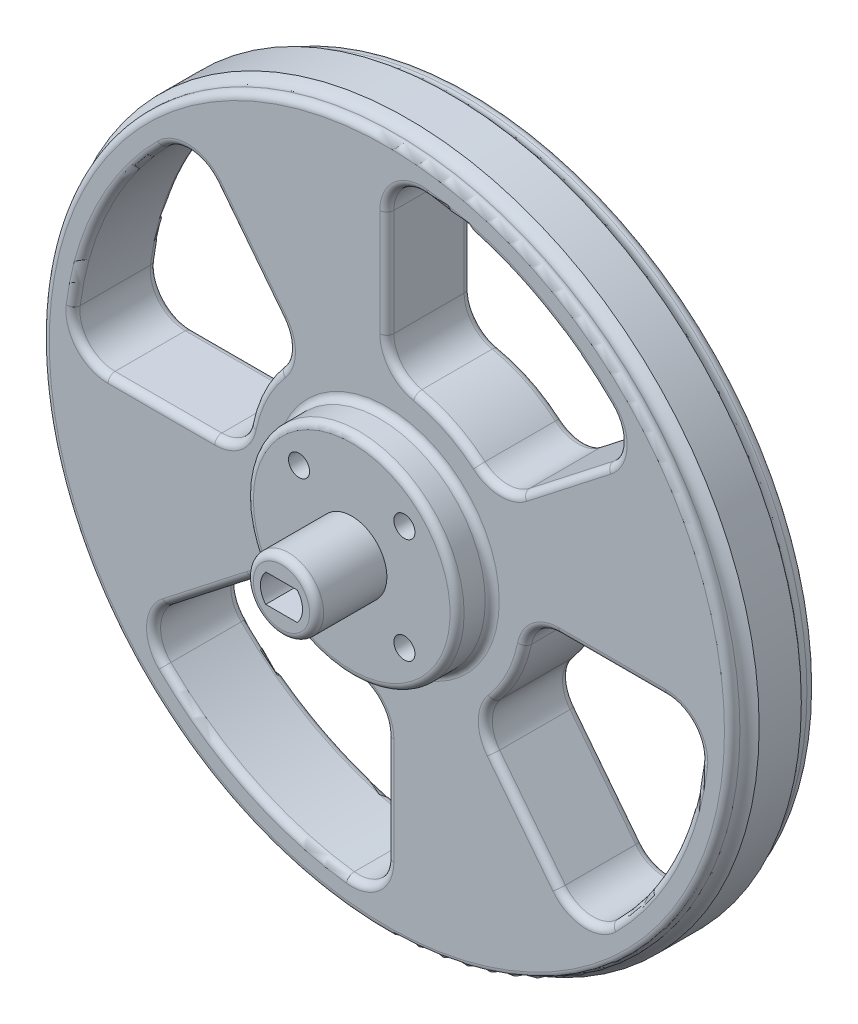
from build123d import *

# Parameters (mm, degrees)
CROQUIS1_R              = 5
SALIENTE_EXTRUIR1_DEPTH = 5
CROQUIS2_R              = 15
SALIENTE_EXTRUIR2_DEPTH = 5
CROQUIS3_R              = 1.5
CORTAR_EXTRUIR1_DEPTH   = 5
REDONDEO1_R             = 1
REDONDEO2_R             = 1
CORTAR_EXTRUIR2_DEPTH   = 73.284161612
REDONDEO3_R             = 1
CORTAR_EXTRUIR4_DEPTH   = 3


with BuildPart() as part:
    # Croquis1 → Saliente-Extruir1 (new, symmetric)
    with BuildSketch(Plane.XY):
        Circle(CROQUIS1_R)
        with BuildLine():
            Line((-2.236067977, -2), (2.236067977, -2))
            ThreePointArc((2.236067977, -2), (3, 0), (2.236067977, 2))
            Line((2.236067977, 2), (-2.236067977, 2))
            ThreePointArc((-2.236067977, 2), (-3, 0), (-2.236067977, -2))
        make_face(mode=Mode.SUBTRACT)
    extrude(amount=SALIENTE_EXTRUIR1_DEPTH, both=True)

    # Croquis2 → Saliente-Extruir2 (add)
    with BuildSketch(Plane(origin=(0, 0, -5), x_dir=(-1, 0, 0), z_dir=(0, 0, -1))):
        Circle(CROQUIS2_R)
    extrude(amount=SALIENTE_EXTRUIR2_DEPTH)

    # Croquis3 → Cortar-Extruir1 (cut)
    with BuildSketch(Plane.XY.offset(-5)):
        with Locations((-7.5, 7.5)):
            Circle(CROQUIS3_R)
        with Locations((7.5, 7.5)):
            Circle(CROQUIS3_R)
        with Locations((-7.5, -7.5)):
            Circle(CROQUIS3_R)
        with Locations((7.5, -7.5)):
            Circle(CROQUIS3_R)
    extrude(amount=-CORTAR_EXTRUIR1_DEPTH, mode=Mode.SUBTRACT)

    # Redondeo1
    redondeo1_edges = [part.edges().sort_by_distance(p)[0] for p in [
        (15, 0, -5),
    ]]
    fillet(redondeo1_edges, radius=REDONDEO1_R)

    # Redondeo2
    redondeo2_edges = [part.edges().sort_by_distance(p)[0] for p in [
        (-5, 0, 5),
    ]]
    fillet(redondeo2_edges, radius=REDONDEO2_R)

    # Croquis5 → Revolución1 (revolve)
    with BuildSketch(Plane(origin=(0, 0, 0), x_dir=(1, 0, 0), z_dir=(0, 1, 0)), mode=Mode.PRIVATE) as revoluci_n1_sk:
        with BuildLine():
            Line((0, 10), (50, 10))
            add(Edge.make_bspline(
                [(50, 10), (48, 11.5), (50, 13)],
                knots=[0, 0, 0, 1, 1, 1], degree=2))
            Line((50, 13), (50, 19))
            add(Edge.make_bspline(
                [(50, 19), (48, 20.5), (50, 22)],
                knots=[0, 0, 0, 1, 1, 1], degree=2))
            Line((50, 22), (0, 22))
            Line((0, 22), (0, 10))
        make_face()
    revolve(revoluci_n1_sk.sketch.rotate(Axis((0, 0, 0), (0, 0, -1)), 180), axis=Axis((0, 0, 0), (0, 0, -1)))

    # Croquis6 → Cortar-Extruir2 (cut, through all)
    with BuildSketch(Plane.XY.offset(-10)):
        with BuildLine():
            Line((0, 24.494897428), (0, 39.686269666))
            ThreePointArc((0, 39.686269666), (1.692810861, 43.436269666), (5.625, 44.647053374))
            ThreePointArc((5.625, 44.647053374), (19.737277716, 40.440572058), (31.735952571, 31.903437345))
            ThreePointArc((31.735952571, 31.903437345), (33.200728678, 28.058630514), (31.285981882, 24.416947755))
            Line((31.285981882, 24.416947755), (19.310127245, 15.070467338))
            ThreePointArc((19.310127245, 15.070467338), (16.123804383, 14.013342389), (12.987104785, 15.209704445))
            ThreePointArc((12.987104785, 15.209704445), (8.772123429, 17.973587581), (4, 19.595917942))
            ThreePointArc((4, 19.595917942), (1.127016654, 21.332619768), (0, 24.494897428))
        make_face()
        with BuildLine():
            Line((15.070467338, -19.310127245), (24.416947755, -31.285981882))
            ThreePointArc((24.416947755, -31.285981882), (28.058630514, -33.200728678), (31.903437345, -31.735952571))
            ThreePointArc((31.903437345, -31.735952571), (40.440572058, -19.737277716), (44.647053374, -5.625))
            ThreePointArc((44.647053374, -5.625), (43.436269666, -1.692810861), (39.686269666, 0))
            Line((39.686269666, 0), (24.494897428, 0))
            ThreePointArc((24.494897428, 0), (21.332619768, -1.127016654), (19.595917942, -4))
            ThreePointArc((19.595917942, -4), (17.973587581, -8.772123429), (15.209704445, -12.987104785))
            ThreePointArc((15.209704445, -12.987104785), (14.013342389, -16.123804383), (15.070467338, -19.310127245))
        make_face()
        with BuildLine():
            Line((-19.310127245, -15.070467338), (-31.285981882, -24.416947755))
            ThreePointArc((-31.285981882, -24.416947755), (-33.200728678, -28.058630514), (-31.735952571, -31.903437345))
            ThreePointArc((-31.735952571, -31.903437345), (-19.737277716, -40.440572058), (-5.625, -44.647053374))
            ThreePointArc((-5.625, -44.647053374), (-1.692810861, -43.436269666), (0, -39.686269666))
            Line((0, -39.686269666), (0, -24.494897428))
            ThreePointArc((0, -24.494897428), (-1.127016654, -21.332619768), (-4, -19.595917942))
            ThreePointArc((-4, -19.595917942), (-8.772123429, -17.973587581), (-12.987104785, -15.209704445))
            ThreePointArc((-12.987104785, -15.209704445), (-16.123804383, -14.013342389), (-19.310127245, -15.070467338))
        make_face()
        with BuildLine():
            Line((-15.070467338, 19.310127245), (-24.416947755, 31.285981882))
            ThreePointArc((-24.416947755, 31.285981882), (-28.058630514, 33.200728678), (-31.903437345, 31.735952571))
            ThreePointArc((-31.903437345, 31.735952571), (-40.440572058, 19.737277716), (-44.647053374, 5.625))
            ThreePointArc((-44.647053374, 5.625), (-43.436269666, 1.692810861), (-39.686269666, 0))
            Line((-39.686269666, 0), (-24.494897428, 0))
            ThreePointArc((-24.494897428, 0), (-21.332619768, 1.127016654), (-19.595917942, 4))
            ThreePointArc((-19.595917942, 4), (-17.973587581, 8.772123429), (-15.209704445, 12.987104785))
            ThreePointArc((-15.209704445, 12.987104785), (-14.013342389, 16.123804383), (-15.070467338, 19.310127245))
        make_face()
    extrude(amount=-CORTAR_EXTRUIR2_DEPTH, mode=Mode.SUBTRACT)

    # Redondeo3
    redondeo3_edges = [part.edges().sort_by_distance(p)[0] for p in [
        (43.436269666, -1.692810861, -22),
        (40.440572058, -19.737277716, -10),
        (43.436269666, -1.692810861, -10),
        (32.090583547, 0, -10),
        (21.332619768, -1.127016654, -10),
        (17.973587581, -8.772123429, -10),
        (14.013342389, -16.123804383, -10),
        (19.743707547, -25.298054563, -10),
        (28.058630514, -33.200728678, -10),
        (-19.737277716, -40.440572058, -22),
        (-33.200728678, -28.058630514, -22),
        (-25.298054563, -19.743707547, -22),
        (-16.123804383, -14.013342389, -22),
        (-8.772123429, -17.973587581, -22),
        (-1.127016654, -21.332619768, -22),
        (0, -32.090583547, -22),
        (-1.692810861, -43.436269666, -22),
        (-19.737277716, -40.440572058, -10),
        (-1.692810861, -43.436269666, -10),
        (0, -32.090583547, -10),
        (-1.127016654, -21.332619768, -10),
        (-8.772123429, -17.973587581, -10),
        (-16.123804383, -14.013342389, -10),
        (-25.298054563, -19.743707547, -10),
        (-33.200728678, -28.058630514, -10),
        (-40.440572058, 19.737277716, -22),
        (-28.058630514, 33.200728678, -22),
        (-19.743707547, 25.298054563, -22),
        (-14.013342389, 16.123804383, -22),
        (-17.973587581, 8.772123429, -22),
        (-21.332619768, 1.127016654, -22),
        (-32.090583547, 0, -22),
        (-43.436269666, 1.692810861, -22),
        (-40.440572058, 19.737277716, -10),
        (-43.436269666, 1.692810861, -10),
        (-32.090583547, 0, -10),
        (-21.332619768, 1.127016654, -10),
        (-17.973587581, 8.772123429, -10),
        (-14.013342389, 16.123804383, -10),
        (-19.743707547, 25.298054563, -10),
        (-28.058630514, 33.200728678, -10),
        (15, 0, -10),
        (50, 0, -10),
        (50, 0, -22),
        (33.200728678, 28.058630514, -22),
        (25.298054563, 19.743707547, -22),
        (16.123804383, 14.013342389, -22),
        (8.772123429, 17.973587581, -22),
        (1.127016654, 21.332619768, -22),
        (0, 32.090583547, -22),
        (1.692810861, 43.436269666, -22),
        (19.737277716, 40.440572058, -22),
        (33.200728678, 28.058630514, -10),
        (19.737277716, 40.440572058, -10),
        (1.692810861, 43.436269666, -10),
        (0, 32.090583547, -10),
        (1.127016654, 21.332619768, -10),
        (8.772123429, 17.973587581, -10),
        (16.123804383, 14.013342389, -10),
        (25.298054563, 19.743707547, -10),
        (40.440572058, -19.737277716, -22),
        (28.058630514, -33.200728678, -22),
        (19.743707547, -25.298054563, -22),
        (14.013342389, -16.123804383, -22),
        (17.973587581, -8.772123429, -22),
        (21.332619768, -1.127016654, -22),
        (32.090583547, 0, -22),
    ]]
    fillet(redondeo3_edges, radius=REDONDEO3_R)

    # Croquis7 → Cortar-Extruir4 (cut)
    # profile 1 of 7: a face of its own
    with BuildSketch(Plane(origin=(0, 0, -22), x_dir=(-1, 0, 0), z_dir=(0, 0, -1))):
        with BuildLine():
            add(Edge.make_bspline(
                [(-8.117944988, 6.634596426), (-8.151341139, 6.63487304), (-8.222105319, 6.635459166), (-8.334527671, 6.637546889), (-8.45951116, 6.640613351), (-8.597085842, 6.644269103), (-8.747175206, 6.650664362), (-8.909858067, 6.657505198), (-9.085431792, 6.665474871), (-9.206771489, 6.671272562), (-9.269593443, 6.674274237)],
                knots=[0, 0, 0, 0, 0.695519731, 1.473759197, 2.341640644, 3.299190386, 4.339796375, 5.470128027, 6.690193691, 8, 8, 8, 8], degree=3))
            add(Edge.make_bspline(
                [(-9.269593443, 6.674274237), (-9.33075756, 6.677380523), (-9.449427532, 6.683407307), (-9.622056758, 6.690027756), (-9.783409805, 6.696095273), (-9.933197327, 6.700936382), (-10.071393642, 6.705359795), (-10.198381018, 6.707024672), (-10.314109517, 6.708207135), (-10.387515476, 6.708066766), (-10.422233843, 6.708000376)],
                knots=[0, 0, 0, 0, 1.274481266, 2.472735077, 3.59508956, 4.634682498, 5.591530519, 6.472399652, 7.27750023, 8, 8, 8, 8], degree=3))
            Line((-10.422233843, 6.708000376), (-10.78131803, 6.708000376))
            add(Edge.make_bspline(
                [(-10.78131803, 6.708000376), (-10.779881304, 6.666658401), (-10.776799027, 6.577965494), (-10.767052099, 6.43583162), (-10.755673489, 6.275723968), (-10.739126503, 6.097578427), (-10.720538912, 5.901808509), (-10.698388107, 5.687908883), (-10.673992318, 5.456040256), (-10.655180201, 5.295451417), (-10.645421528, 5.212146914)],
                knots=[0, 0, 0, 0, 0.660782525, 1.417608192, 2.275642426, 3.224896499, 4.275543834, 5.417111509, 6.660141979, 8, 8, 8, 8], degree=3))
            add(Edge.make_bspline(
                [(-10.645421528, 5.212146914), (-10.636742221, 5.134123331), (-10.619867783, 4.982428713), (-10.59664735, 4.761285963), (-10.578303187, 4.553553144), (-10.561757236, 4.359528176), (-10.550236663, 4.178927378), (-10.540829087, 4.011641149), (-10.53588372, 3.857840642), (-10.534826944, 3.759941677), (-10.534323658, 3.713317616)],
                knots=[0, 0, 0, 0, 1.253038777, 2.436176741, 3.548990284, 4.58157199, 5.544172607, 6.43734329, 7.255789853, 8, 8, 8, 8], degree=3))
            add(Edge.make_bspline(
                [(-10.534323658, 3.713317616), (-10.533934663, 3.691149481), (-10.533073847, 3.642093151), (-10.525013319, 3.561109178), (-10.514245048, 3.465202084), (-10.499958666, 3.359098194), (-10.483613068, 3.253281194), (-10.473147555, 3.156616831), (-10.465163658, 3.074636633), (-10.464288832, 3.024591295), (-10.463895544, 3.002092859)],
                knots=[0, 0, 0, 0, 0.743705588, 1.645761725, 2.728888485, 3.982639446, 5.237911385, 6.321038145, 7.245204138, 8, 8, 8, 8], degree=3))
            add(Edge.make_bspline(
                [(-10.463895544, 3.002092859), (-10.465157976, 2.965611631), (-10.467624388, 2.894338329), (-10.488898735, 2.791711072), (-10.523359837, 2.696217704), (-10.557808305, 2.639540604), (-10.574993414, 2.611266424)],
                knots=[0, 0, 0, 0, 1.061117577, 2.07310329, 3.038740109, 4, 4, 4, 4], degree=3))
            add(Edge.make_bspline(
                [(-10.574993414, 2.611266424), (-10.58710243, 2.593718371), (-10.610913694, 2.559211742), (-10.654256484, 2.51393303), (-10.703047082, 2.476346272), (-10.756506816, 2.445343803), (-10.81413488, 2.419869783), (-10.877549438, 2.4038961), (-10.945206292, 2.392027595), (-10.992213638, 2.391385217), (-11.016409058, 2.391054575)],
                knots=[0, 0, 0, 0, 0.990060698, 1.946863095, 2.900077549, 3.84394959, 4.81484951, 5.817951923, 6.876865594, 8, 8, 8, 8], degree=3))
            add(Edge.make_bspline(
                [(-11.016409058, 2.391054575), (-11.049227888, 2.392158623), (-11.114041147, 2.394338984), (-11.208364585, 2.412775573), (-11.298088807, 2.441852587), (-11.380649817, 2.480932524), (-11.45148546, 2.530263404), (-11.503780437, 2.588795922), (-11.53794559, 2.654939932), (-11.541398453, 2.702469444), (-11.543131994, 2.726332075)],
                knots=[0, 0, 0, 0, 1.147745919, 2.266660676, 3.34987912, 4.441962422, 5.45358366, 6.34734105, 7.170267267, 8, 8, 8, 8], degree=3))
            add(Edge.make_bspline(
                [(-11.543131994, 2.726332075), (-11.541679727, 2.747243212), (-11.5381615, 2.797902014), (-11.521146659, 2.862964889), (-11.507844376, 2.921276524), (-11.499168042, 2.962157625), (-11.495508582, 2.996747056), (-11.494141148, 3.017630356), (-11.493534731, 3.026891491)],
                knots=[0, 0, 0, 0, 1.234310819, 2.990210845, 3.950670545, 4.765414208, 5.45249715, 6, 6, 6, 6], degree=3))
            add(Edge.make_bspline(
                [(-11.493534731, 3.026891491), (-11.493997862, 3.057648431), (-11.495029355, 3.126150882), (-11.501610708, 3.239249181), (-11.511467285, 3.372852254), (-11.525278804, 3.51988819), (-11.539079853, 3.666924693), (-11.548986807, 3.800855658), (-11.555524785, 3.91461837), (-11.556555805, 3.983781503), (-11.557019228, 4.014868977)],
                knots=[0, 0, 0, 0, 0.745395476, 1.660159205, 2.744898548, 3.991993254, 5.239087959, 6.323827302, 7.246593204, 8, 8, 8, 8], degree=3))
            add(Edge.make_bspline(
                [(-11.557019228, 4.014868977), (-11.557521763, 4.056864236), (-11.558574604, 4.144846834), (-11.563504858, 4.28278313), (-11.572985271, 4.432868521), (-11.584470619, 4.59529217), (-11.600912797, 4.769811995), (-11.619371203, 4.956382412), (-11.642651739, 5.155025717), (-11.659450081, 5.291511515), (-11.668117098, 5.361930649)],
                knots=[0, 0, 0, 0, 0.74529116, 1.561429903, 2.44902602, 3.413902559, 4.450877594, 5.559625779, 6.740901688, 8, 8, 8, 8], degree=3))
            add(Edge.make_bspline(
                [(-11.668117098, 5.361930649), (-11.677000476, 5.437323708), (-11.694104935, 5.582488922), (-11.719506483, 5.79197407), (-11.740446847, 5.985078405), (-11.75677814, 6.161765216), (-11.772051186, 6.321733056), (-11.784256883, 6.465200213), (-11.792229794, 6.592215758), (-11.795535477, 6.67129268), (-11.797069983, 6.708000376)],
                knots=[0, 0, 0, 0, 1.34702002, 2.593613418, 3.744291121, 4.793366942, 5.74204272, 6.595664241, 7.348103994, 8, 8, 8, 8], degree=3))
            Line((-11.797069983, 6.708000376), (-12.256340641, 6.70502454))
            add(Edge.make_bspline(
                [(-12.256340641, 6.70502454), (-12.345949143, 6.705448705), (-12.520220104, 6.706273622), (-12.774175567, 6.711397645), (-13.013297628, 6.718807894), (-13.237492275, 6.730915646), (-13.446838688, 6.745639154), (-13.641705139, 6.763176923), (-13.821679837, 6.784605638), (-13.936411305, 6.802573873), (-13.991252913, 6.811162684)],
                knots=[0, 0, 0, 0, 1.236022299, 2.40382096, 3.503589712, 4.535792375, 5.500559059, 6.398246184, 7.234362162, 8, 8, 8, 8], degree=3))
            add(Edge.make_bspline(
                [(-13.991252913, 6.811162684), (-14.023512227, 6.817375672), (-14.084141421, 6.829052561), (-14.167283935, 6.856579564), (-14.238965678, 6.887255126), (-14.297412533, 6.926285784), (-14.343680236, 6.971395803), (-14.375695681, 7.023309508), (-14.397491281, 7.08062398), (-14.399103277, 7.121432845), (-14.399934363, 7.142472403)],
                knots=[0, 0, 0, 0, 1.366814623, 2.56883543, 3.641359145, 4.603910224, 5.480343812, 6.309517489, 7.128449089, 8, 8, 8, 8], degree=3))
            add(Edge.make_bspline(
                [(-14.399934363, 7.142472403), (-14.398513249, 7.164878334), (-14.395664637, 7.209790852), (-14.368816697, 7.273647134), (-14.327000269, 7.333135063), (-14.289024101, 7.365470992), (-14.268997587, 7.382523157)],
                knots=[0, 0, 0, 0, 0.945273965, 1.894794511, 2.88983203, 4, 4, 4, 4], degree=3))
            add(Edge.make_bspline(
                [(-14.268997587, 7.382523157), (-14.242519831, 7.400575728), (-14.188796037, 7.437204684), (-14.094310939, 7.470869412), (-13.99044689, 7.49045905), (-13.917946486, 7.489929354), (-13.880155043, 7.489653246)],
                knots=[0, 0, 0, 0, 0.931405003, 1.889835684, 2.900059167, 4, 4, 4, 4], degree=3))
            add(Edge.make_bspline(
                [(-13.880155043, 7.489653246), (-13.862957833, 7.489067606), (-13.823909502, 7.48773784), (-13.758439898, 7.483540524), (-13.679126869, 7.477343727), (-13.585554491, 7.470378854), (-13.477710823, 7.46279217), (-13.355763531, 7.45240871), (-13.219479298, 7.44186554), (-13.123954973, 7.433529719), (-13.073703541, 7.429144585)],
                knots=[0, 0, 0, 0, 0.510594254, 1.159365614, 1.94651944, 2.871388623, 3.943758658, 5.154600127, 6.503151737, 8, 8, 8, 8], degree=3))
            add(Edge.make_bspline(
                [(-13.073703541, 7.429144585), (-12.993695785, 7.423403533), (-12.841664383, 7.412494338), (-12.62546952, 7.398838867), (-12.432949852, 7.392002075), (-12.312554438, 7.390273747), (-12.256340641, 7.389466774)],
                knots=[0, 0, 0, 0, 1.176030458, 2.234702849, 3.175765476, 4, 4, 4, 4], degree=3))
            add(Edge.make_bspline(
                [(-12.256340641, 7.389466774), (-12.229557585, 7.389369312), (-12.172683107, 7.389162349), (-12.082423928, 7.390926527), (-11.982229506, 7.39005203), (-11.872459732, 7.391700789), (-11.752755554, 7.392104319), (-11.623488815, 7.394929553), (-11.48426938, 7.39505919), (-11.338792933, 7.39755375), (-11.193303184, 7.399160074), (-11.054110763, 7.401726093), (-10.924809402, 7.401888054), (-10.805132174, 7.404523857), (-10.695351808, 7.405644427), (-10.595158891, 7.404892997), (-10.504899373, 7.406629492), (-10.448024935, 7.406425776), (-10.421241898, 7.406329844)],
                knots=[0, 0, 0, 0, 0.700500997, 1.487531113, 2.360995319, 3.320980084, 4.358795371, 5.491836416, 6.702609765, 7.999949136, 9.297288507, 10.508154509, 11.641096536, 12.679019916, 13.639004681, 14.512468887, 15.299499003, 16, 16, 16, 16], degree=3))
            add(Edge.make_bspline(
                [(-10.421241898, 7.406329844), (-10.38685507, 7.405958092), (-10.31411405, 7.405171697), (-10.19935878, 7.404801632), (-10.072734607, 7.401158935), (-9.934491873, 7.397787055), (-9.784432556, 7.390928596), (-9.62301545, 7.385846812), (-9.449792158, 7.377310422), (-9.268601035, 7.368649008), (-9.087412625, 7.359910908), (-8.914181912, 7.351584261), (-8.752471101, 7.345797794), (-8.602331285, 7.341253959), (-8.464162412, 7.335688669), (-8.337841026, 7.332566702), (-8.22308962, 7.332079734), (-8.150348143, 7.331307202), (-8.115961098, 7.330942003)],
                knots=[0, 0, 0, 0, 0.715590798, 1.513742526, 2.387792345, 3.351436205, 4.391190823, 5.513449479, 6.711897273, 8.000014366, 9.288131459, 10.486579253, 11.608837908, 12.655218703, 13.612207655, 14.486257474, 15.284409202, 16, 16, 16, 16], degree=3))
            add(Edge.make_bspline(
                [(-8.115961098, 7.330942003), (-8.081147455, 7.329992644), (-8.014264287, 7.328168758), (-7.918239749, 7.308797557), (-7.831221409, 7.277038331), (-7.753897579, 7.233790455), (-7.689683542, 7.181471919), (-7.641439517, 7.121102328), (-7.611978967, 7.053037073), (-7.608721361, 7.004863145), (-7.607093176, 6.980785324)],
                knots=[0, 0, 0, 0, 1.221503685, 2.346724767, 3.423363478, 4.463486645, 5.444956809, 6.313867696, 7.157253858, 8, 8, 8, 8], degree=3))
            add(Edge.make_bspline(
                [(-7.607093176, 6.980785324), (-7.608642178, 6.956990206), (-7.611723001, 6.909663912), (-7.642366427, 6.842998424), (-7.688921891, 6.782023717), (-7.754377955, 6.731024705), (-7.831176854, 6.686935826), (-7.919522636, 6.657112692), (-8.015886979, 6.637329346), (-8.083118876, 6.635529003), (-8.117944988, 6.634596426)],
                knots=[0, 0, 0, 0, 0.832545856, 1.655856807, 2.535354058, 3.51099397, 4.552772878, 5.638130258, 6.776551839, 8, 8, 8, 8], degree=3))
        make_face()
    # profile 2 of 7: a face of its own
    with BuildSketch(Plane(origin=(0, 0, -22), x_dir=(-1, 0, 0), z_dir=(0, 0, -1))):
        with BuildLine():
            add(Edge.make_bspline(
                [(1.333309513, 6.961938364), (1.308810661, 6.962522699), (1.257352617, 6.963750052), (1.206303138, 6.97037228), (1.179557997, 6.973841707)],
                knots=[0, 0, 0, 0, 0.952187476, 2, 2, 2, 2], degree=3))
            add(Edge.make_bspline(
                [(1.179557997, 6.973841707), (1.040797821, 6.991733684), (0.766398217, 7.027115244), (0.35702027, 7.06172674), (-0.044558615, 7.085082127), (-0.309980741, 7.087641353), (-0.441280569, 7.088907358)],
                knots=[0, 0, 0, 0, 1.032346871, 2.041476044, 3.031151383, 4, 4, 4, 4], degree=3))
            add(Edge.make_bspline(
                [(-0.441280569, 7.088907358), (-0.510720598, 7.088505185), (-0.652931073, 7.087681551), (-0.870858518, 7.081420905), (-1.098036496, 7.071472099), (-1.334479481, 7.057586141), (-1.580098289, 7.039190168), (-1.83522928, 7.019398422), (-2.099239194, 6.991493826), (-2.278370529, 6.971913047), (-2.369622168, 6.961938364)],
                knots=[0, 0, 0, 0, 0.861921273, 1.765181204, 2.705938894, 3.684427211, 4.70494648, 5.763241558, 6.860568572, 8, 8, 8, 8], degree=3))
            add(Edge.make_bspline(
                [(-2.369622168, 6.961938364), (-2.369622168, 6.925567038), (-2.369622168, 6.856792166), (-2.369622168, 6.759250881), (-2.369622168, 6.673282292), (-2.369622168, 6.619717247), (-2.369622168, 6.594918616)],
                knots=[0, 0, 0, 0, 1.189189189, 2.248648649, 3.189189189, 4, 4, 4, 4], degree=3))
            add(Edge.make_bspline(
                [(-2.369622168, 6.594918616), (-2.3698309, 6.552263462), (-2.370267825, 6.462976083), (-2.373463522, 6.32310326), (-2.378387323, 6.171988152), (-2.385489557, 6.009308621), (-2.394377473, 5.835380344), (-2.405396683, 5.649557681), (-2.418222042, 5.452482402), (-2.42805628, 5.317286803), (-2.433106665, 5.247856943)],
                knots=[0, 0, 0, 0, 0.758969037, 1.588702664, 2.48932873, 3.449191197, 4.48600567, 5.588085321, 6.761358371, 8, 8, 8, 8], degree=3))
            Line((-2.433106665, 5.247856943), (-0.25876264, 5.376809828))
            add(Edge.make_bspline(
                [(-0.25876264, 5.376809828), (-0.182392745, 5.381930101), (-0.03761666, 5.391636715), (0.168122811, 5.40296256), (0.350277665, 5.414056834), (0.509277941, 5.423558808), (0.645238125, 5.428894622), (0.757959081, 5.434185487), (0.847568009, 5.437471664), (0.899497061, 5.438059597), (0.921652227, 5.438310435)],
                knots=[0, 0, 0, 0, 1.553973734, 2.94590208, 4.183303241, 5.259084488, 6.179649941, 6.945670055, 7.550177501, 8, 8, 8, 8], degree=3))
            add(Edge.make_bspline(
                [(0.921652227, 5.438310435), (0.956788492, 5.437274743), (1.024574402, 5.435276657), (1.122017154, 5.416920286), (1.210973291, 5.387728253), (1.289330146, 5.346027434), (1.355668287, 5.295752505), (1.404195126, 5.234131819), (1.435186231, 5.163593166), (1.438010636, 5.112935671), (1.439447656, 5.08716181)],
                knots=[0, 0, 0, 0, 1.211934539, 2.338099562, 3.410205209, 4.43151934, 5.390657176, 6.260677425, 7.115055756, 8, 8, 8, 8], degree=3))
            add(Edge.make_bspline(
                [(1.439447656, 5.08716181), (1.438231134, 5.062545264), (1.435896651, 5.015306597), (1.414680774, 4.948427601), (1.37739122, 4.891666735), (1.327237142, 4.842558435), (1.2623574, 4.803064354), (1.183736766, 4.772650797), (1.091515141, 4.751230718), (1.025253753, 4.74388075), (0.990096451, 4.739980967)],
                knots=[0, 0, 0, 0, 0.930983282, 1.786538625, 2.620364978, 3.479488391, 4.424768962, 5.476043727, 6.660826494, 8, 8, 8, 8], degree=3))
            Line((0.990096451, 4.739980967), (-0.195278143, 4.67649647))
            Line((-0.195278143, 4.67649647), (-2.496591162, 4.549527476))
            add(Edge.make_bspline(
                [(-2.496591162, 4.549527476), (-2.504981869, 4.473822799), (-2.521313559, 4.326471051), (-2.54299763, 4.112041437), (-2.556473215, 3.910552737), (-2.558904474, 3.780787675), (-2.560075659, 3.718277342)],
                knots=[0, 0, 0, 0, 1.095838068, 2.132941601, 3.100601969, 4, 4, 4, 4], degree=3))
            add(Edge.make_bspline(
                [(-2.560075659, 3.718277342), (-2.559372282, 3.660739245), (-2.558045825, 3.552231619), (-2.551806733, 3.398633069), (-2.539230273, 3.263835635), (-2.521465077, 3.147656301), (-2.500780696, 3.049205928), (-2.473580772, 2.969853), (-2.442006333, 2.907026949), (-2.41266377, 2.877554508), (-2.399380526, 2.864212467)],
                knots=[0, 0, 0, 0, 1.558159785, 2.93843952, 4.161681, 5.221578245, 6.120870264, 6.879764692, 7.492874578, 8, 8, 8, 8], degree=3))
            add(Edge.make_bspline(
                [(-2.399380526, 2.864212467), (-2.386723341, 2.856431235), (-2.357350335, 2.838373651), (-2.300239041, 2.821410682), (-2.227366829, 2.805597956), (-2.137412962, 2.793514574), (-2.030543299, 2.78362311), (-1.906763149, 2.777438151), (-1.765907745, 2.771829489), (-1.666340379, 2.771915916), (-1.613759875, 2.771961558)],
                knots=[0, 0, 0, 0, 0.445365802, 1.033542066, 1.776854275, 2.691152828, 3.760040009, 5.005270078, 6.418513855, 8, 8, 8, 8], degree=3))
            add(Edge.make_bspline(
                [(-1.613759875, 2.771961558), (-1.586316055, 2.771961558), (-1.528121933, 2.771961558), (-1.435871023, 2.771961558), (-1.333700661, 2.771961558), (-1.221941494, 2.771961558), (-1.100262875, 2.771961558), (-0.968995451, 2.771961558), (-0.827808575, 2.771961558), (-0.680339379, 2.771961558), (-0.532539534, 2.771961558), (-0.391022009, 2.771961558), (-0.259093289, 2.771961558), (-0.136753372, 2.771961558), (-0.02400226, 2.771961558), (0.079160047, 2.771961558), (0.172402902, 2.771961558), (0.231258322, 2.771961558), (0.259032789, 2.771961558)],
                knots=[0, 0, 0, 0, 0.703389831, 1.491525424, 2.36440678, 3.322033898, 4.355932203, 5.483050847, 6.686440678, 7.974576271, 9.262711864, 10.474576271, 11.601694915, 12.644067797, 13.610169492, 14.491525424, 15.288135593, 16, 16, 16, 16], degree=3))
            add(Edge.make_bspline(
                [(0.259032789, 2.771961558), (0.277891624, 2.772411418), (0.319322237, 2.773399709), (0.38745518, 2.780087126), (0.467191683, 2.789825715), (0.554631044, 2.803714951), (0.64175453, 2.817488814), (0.720815863, 2.827321552), (0.787299572, 2.833926138), (0.827406338, 2.834977646), (0.845272442, 2.835446055)],
                knots=[0, 0, 0, 0, 0.766909498, 1.684808807, 2.782226106, 4.033524913, 5.284823721, 6.368897308, 7.27340315, 8, 8, 8, 8], degree=3))
            add(Edge.make_bspline(
                [(0.845272442, 2.835446055), (0.886649277, 2.834242302), (0.964451417, 2.831978849), (1.073365412, 2.817133758), (1.166076733, 2.789848998), (1.242586426, 2.750976918), (1.303787793, 2.700670654), (1.346246166, 2.637106074), (1.37243838, 2.562628016), (1.374749081, 2.509326852), (1.375963159, 2.481321594)],
                knots=[0, 0, 0, 0, 1.373636305, 2.582890747, 3.638458043, 4.566341692, 5.415226804, 6.237215828, 7.073805895, 8, 8, 8, 8], degree=3))
            add(Edge.make_bspline(
                [(1.375963159, 2.481321594), (1.374629564, 2.458682118), (1.37202506, 2.414467374), (1.351640758, 2.35191447), (1.318200592, 2.29633195), (1.269220981, 2.24998544), (1.207926611, 2.210430135), (1.133614049, 2.177821414), (1.04607892, 2.153251698), (0.982959227, 2.143362303), (0.949426695, 2.138108532)],
                knots=[0, 0, 0, 0, 0.897049597, 1.751931754, 2.582393869, 3.445395509, 4.40262307, 5.465874389, 6.653737908, 8, 8, 8, 8], degree=3))
            add(Edge.make_bspline(
                [(0.949426695, 2.138108532), (0.928280662, 2.135324798), (0.883417746, 2.129418893), (0.811566644, 2.122986394), (0.73127447, 2.115643332), (0.641934435, 2.110121756), (0.544061052, 2.104273348), (0.437649892, 2.097587011), (0.322820259, 2.094833845), (0.1995475, 2.088983961), (0.067601281, 2.08525225), (-0.073268929, 2.082588445), (-0.222710585, 2.079203529), (-0.380773301, 2.077706408), (-0.547081895, 2.075254598), (-0.722001978, 2.074754883), (-0.905509083, 2.073329303), (-1.030826375, 2.073529576), (-1.0949725, 2.07363209)],
                knots=[0, 0, 0, 0, 0.500224831, 1.061264989, 1.69181467, 2.391373191, 3.160592038, 3.991750978, 4.891941877, 5.854424819, 6.88639357, 7.987942581, 9.159277859, 10.392524837, 11.6955675, 13.060585124, 14.495402587, 16, 16, 16, 16], degree=3))
            add(Edge.make_bspline(
                [(-1.0949725, 2.07363209), (-1.158456983, 2.073850333), (-1.282457424, 2.074276615), (-1.464024325, 2.076784577), (-1.636589077, 2.083482644), (-1.800674441, 2.089595676), (-1.956069595, 2.099865079), (-2.10291958, 2.111544489), (-2.240815556, 2.125509757), (-2.370264332, 2.140854675), (-2.490792452, 2.160316933), (-2.603214778, 2.179281159), (-2.706345193, 2.202373423), (-2.800731718, 2.226907082), (-2.886491539, 2.253716973), (-2.963695141, 2.282322668), (-3.032964954, 2.312320597), (-3.074116796, 2.336750328), (-3.093742212, 2.348400929)],
                knots=[0, 0, 0, 0, 1.497312098, 2.924610086, 4.282337261, 5.570229816, 6.797058842, 7.955008862, 9.044470006, 10.065910881, 11.028783704, 11.923698345, 12.754328062, 13.520398796, 14.223336598, 14.872292376, 15.462193388, 16, 16, 16, 16], degree=3))
            add(Edge.make_bspline(
                [(-3.093742212, 2.348400929), (-3.132720084, 2.375682488), (-3.212327687, 2.431401783), (-3.310433038, 2.546120974), (-3.393483849, 2.683328943), (-3.459877504, 2.844978776), (-3.513391261, 3.029441396), (-3.550137062, 3.238257536), (-3.571284624, 3.471173281), (-3.574264851, 3.634576445), (-3.575827612, 3.720261233)],
                knots=[0, 0, 0, 0, 0.751654116, 1.535162888, 2.370270163, 3.286329801, 4.296467267, 5.409895658, 6.641810019, 8, 8, 8, 8], degree=3))
            add(Edge.make_bspline(
                [(-3.575827612, 3.720261233), (-3.575065394, 3.795004397), (-3.573472476, 3.951205931), (-3.559471372, 4.19562781), (-3.538087226, 4.46005842), (-3.521131358, 4.643117414), (-3.512343115, 4.737997076)],
                knots=[0, 0, 0, 0, 0.879191434, 1.837372699, 2.879108073, 4, 4, 4, 4], degree=3))
            add(Edge.make_bspline(
                [(-3.512343115, 4.737997076), (-3.522015935, 4.750955428), (-3.540548373, 4.775782712), (-3.561035601, 4.816525404), (-3.573500599, 4.858608087), (-3.575054893, 4.887369358), (-3.575827612, 4.901668045)],
                knots=[0, 0, 0, 0, 1.082538007, 2.074066105, 3.042520585, 4, 4, 4, 4], degree=3))
            add(Edge.make_bspline(
                [(-3.575827612, 4.901668045), (-3.574294221, 4.920451313), (-3.571183736, 4.958553175), (-3.544954671, 5.012781944), (-3.504115761, 5.063444043), (-3.46807297, 5.091207902), (-3.448858618, 5.10600877)],
                knots=[0, 0, 0, 0, 0.898305331, 1.822212474, 2.839025067, 4, 4, 4, 4], degree=3))
            add(Edge.make_bspline(
                [(-3.448858618, 5.10600877), (-3.438794798, 5.184023772), (-3.419359576, 5.334686135), (-3.393581172, 5.552926491), (-3.371645691, 5.755283292), (-3.35369748, 5.941775377), (-3.339660205, 6.11240042), (-3.329642082, 6.267491217), (-3.323259496, 6.406725871), (-3.32232617, 6.494395864), (-3.321889624, 6.5354019)],
                knots=[0, 0, 0, 0, 1.314808897, 2.539155398, 3.673149545, 4.716929962, 5.670674606, 6.534617075, 7.314593951, 8, 8, 8, 8], degree=3))
            add(Edge.make_bspline(
                [(-3.321889624, 6.5354019), (-3.322801845, 6.558584359), (-3.324818043, 6.609822435), (-3.338082007, 6.693557681), (-3.357767317, 6.791551256), (-3.385539824, 6.898743736), (-3.412820424, 7.006057364), (-3.432688746, 7.104337084), (-3.445867492, 7.187751587), (-3.44793191, 7.238655359), (-3.448858618, 7.261505835)],
                knots=[0, 0, 0, 0, 0.753165655, 1.664653368, 2.749593925, 4.000147464, 5.261130312, 6.34607087, 7.257558583, 8, 8, 8, 8], degree=3))
            add(Edge.make_bspline(
                [(-3.448858618, 7.261505835), (-3.447525954, 7.292761283), (-3.444986345, 7.352323622), (-3.420723453, 7.435405846), (-3.381214172, 7.506480732), (-3.325192721, 7.564888943), (-3.251552269, 7.607453688), (-3.164358077, 7.639091916), (-3.061439765, 7.657655524), (-2.988013424, 7.659360195), (-2.948918204, 7.660267832)],
                knots=[0, 0, 0, 0, 1.025629323, 1.954503427, 2.816180211, 3.677308155, 4.579720518, 5.587505382, 6.715488092, 8, 8, 8, 8], degree=3))
            add(Edge.make_bspline(
                [(-2.948918204, 7.660267832), (-2.915107456, 7.659181139), (-2.849301342, 7.657066101), (-2.754341485, 7.639037458), (-2.666620284, 7.60874462), (-2.614538298, 7.578151325), (-2.588842072, 7.563057196)],
                knots=[0, 0, 0, 0, 1.072241718, 2.08691221, 3.056120157, 4, 4, 4, 4], degree=3))
            add(Edge.make_bspline(
                [(-2.588842072, 7.563057196), (-2.490371902, 7.580940296), (-2.296376068, 7.616171746), (-2.009046533, 7.66199337), (-1.730093833, 7.699148146), (-1.459688401, 7.731580796), (-1.197388458, 7.756138483), (-0.942762663, 7.774591368), (-0.695955836, 7.784301224), (-0.533869036, 7.786269221), (-0.454175858, 7.787236826)],
                knots=[0, 0, 0, 0, 1.117516841, 2.201617128, 3.2485457, 4.25972767, 5.242483099, 6.189998739, 7.110077109, 8, 8, 8, 8], degree=3))
            add(Edge.make_bspline(
                [(-0.454175858, 7.787236826), (-0.35530384, 7.786722263), (-0.162808016, 7.78572045), (0.117959974, 7.776336837), (0.383243155, 7.762890421), (0.633404866, 7.743564828), (0.868210103, 7.716602018), (1.08781561, 7.684728866), (1.292464075, 7.649580209), (1.422401238, 7.617978341), (1.485077139, 7.602735007)],
                knots=[0, 0, 0, 0, 1.215212123, 2.36591974, 3.452511749, 4.479872731, 5.449282845, 6.356804419, 7.207395625, 8, 8, 8, 8], degree=3))
            add(Edge.make_bspline(
                [(1.485077139, 7.602735007), (1.51135457, 7.595281817), (1.561331383, 7.581106663), (1.62998044, 7.553509173), (1.688691715, 7.52178619), (1.736587474, 7.485554808), (1.773781408, 7.44437176), (1.801371263, 7.399301166), (1.817738954, 7.348893237), (1.819478698, 7.313861831), (1.820354639, 7.296223919)],
                knots=[0, 0, 0, 0, 1.331955652, 2.533234674, 3.601862374, 4.579557797, 5.447703054, 6.294296858, 7.141198012, 8, 8, 8, 8], degree=3))
            add(Edge.make_bspline(
                [(1.820354639, 7.296223919), (1.818808024, 7.275497885), (1.815685585, 7.233654403), (1.790131485, 7.173329379), (1.747886225, 7.117691178), (1.71095254, 7.086546685), (1.691401754, 7.070060398)],
                knots=[0, 0, 0, 0, 0.919443303, 1.856250417, 2.865209693, 4, 4, 4, 4], degree=3))
            add(Edge.make_bspline(
                [(1.691401754, 7.070060398), (1.666497714, 7.053171391), (1.616211746, 7.01906929), (1.528877677, 6.985944159), (1.433767641, 6.965830256), (1.367474542, 6.963261966), (1.333309513, 6.961938364)],
                knots=[0, 0, 0, 0, 0.946316443, 1.910791887, 2.923298826, 4, 4, 4, 4], degree=3))
        make_face()
    # profile 3 of 7: a face of its own
    with BuildSketch(Plane(origin=(0, 0, -22), x_dir=(-1, 0, 0), z_dir=(0, 0, -1))):
        with BuildLine():
            add(Edge.make_bspline(
                [(11.39957008, 6.136639902), (11.374403537, 6.137407996), (11.325099545, 6.138912774), (11.253520815, 6.150467131), (11.187068214, 6.17200314), (11.125302832, 6.200321688), (11.068952658, 6.238050301), (11.017162326, 6.282857067), (10.969645096, 6.335929053), (10.943708547, 6.3766139), (10.930379968, 6.397521507)],
                knots=[0, 0, 0, 0, 1.0711173, 2.098435224, 3.073217483, 4.036552961, 4.981201278, 5.949049851, 6.946033615, 8, 8, 8, 8], degree=3))
            add(Edge.make_bspline(
                [(10.930379968, 6.397521507), (10.907974946, 6.431815887), (10.866809493, 6.494826029), (10.799494963, 6.574025524), (10.736510572, 6.63482634), (10.689602289, 6.658615782), (10.668506418, 6.669314511)],
                knots=[0, 0, 0, 0, 1.283269156, 2.357790726, 3.261455917, 4, 4, 4, 4], degree=3))
            add(Edge.make_bspline(
                [(10.668506418, 6.669314511), (10.657969706, 6.672468696), (10.634191966, 6.679586611), (10.592639539, 6.687052583), (10.541709501, 6.694069043), (10.480700947, 6.698187667), (10.410353294, 6.70381384), (10.330271871, 6.706466749), (10.240316797, 6.706951135), (10.177162761, 6.707637455), (10.143767372, 6.708000376)],
                knots=[0, 0, 0, 0, 0.49993835, 1.128189119, 1.917300703, 2.837790968, 3.908244713, 5.12728483, 6.48092935, 8, 8, 8, 8], degree=3))
            add(Edge.make_bspline(
                [(10.143767372, 6.708000376), (10.08177966, 6.705572786), (9.955556187, 6.700629566), (9.764392093, 6.663555923), (9.568466432, 6.605716203), (9.367306807, 6.524475972), (9.161453289, 6.419556959), (8.951569822, 6.290035497), (8.734331813, 6.141042238), (8.593572008, 6.026901698), (8.520944916, 5.968009207)],
                knots=[0, 0, 0, 0, 0.817960052, 1.665584271, 2.562012189, 3.512019388, 4.52520202, 5.608469233, 6.766054514, 8, 8, 8, 8], degree=3))
            add(Edge.make_bspline(
                [(8.520944916, 5.968009207), (8.471741663, 5.926989774), (8.375417274, 5.846686712), (8.238517102, 5.723535561), (8.111286086, 5.601319801), (7.993171215, 5.480251654), (7.883526753, 5.360488531), (7.784425932, 5.240479617), (7.69491235, 5.121176589), (7.614443128, 5.003036854), (7.542338796, 4.886007436), (7.481111663, 4.769161891), (7.428999675, 4.653257912), (7.386031118, 4.538417252), (7.353407532, 4.4238785), (7.32915207, 4.310627753), (7.314916821, 4.197750254), (7.312812369, 4.12269844), (7.311763635, 4.085297091)],
                knots=[0, 0, 0, 0, 1.331936564, 2.607510033, 3.828030088, 4.999782174, 6.124099406, 7.203367179, 8.234682107, 9.224410158, 10.174812858, 11.091285104, 11.965303801, 12.815886827, 13.638471383, 14.439451934, 15.222315903, 16, 16, 16, 16], degree=3))
            add(Edge.make_bspline(
                [(7.311763635, 4.085297091), (7.313261534, 4.050175667), (7.316236277, 3.980426465), (7.335124405, 3.877461479), (7.368406516, 3.778580664), (7.414405798, 3.683573414), (7.473913046, 3.592724851), (7.545671243, 3.504899348), (7.631367348, 3.421666095), (7.695497858, 3.371188306), (7.728380647, 3.345305922)],
                knots=[0, 0, 0, 0, 0.955150203, 1.89687543, 2.835160553, 3.784197189, 4.759324855, 5.781644161, 6.862542544, 8, 8, 8, 8], degree=3))
            add(Edge.make_bspline(
                [(7.728380647, 3.345305922), (7.764353317, 3.319896714), (7.83638683, 3.269016018), (7.951519599, 3.203775151), (8.072408974, 3.148806177), (8.199062375, 3.104476979), (8.330812693, 3.068248587), (8.468317131, 3.044029262), (8.610856497, 3.028580568), (8.70771986, 3.026803936), (8.757027889, 3.025899546)],
                knots=[0, 0, 0, 0, 0.963746288, 1.929854869, 2.891995842, 3.867335228, 4.864747936, 5.879969272, 6.920804188, 8, 8, 8, 8], degree=3))
            add(Edge.make_bspline(
                [(8.757027889, 3.025899546), (8.84343906, 3.027979704), (9.017200286, 3.032162622), (9.27739917, 3.066981145), (9.53900194, 3.119035284), (9.710037219, 3.172456916), (9.796586529, 3.199489968)],
                knots=[0, 0, 0, 0, 0.979451519, 1.969545101, 2.972525017, 4, 4, 4, 4], degree=3))
            add(Edge.make_bspline(
                [(9.796586529, 3.199489968), (9.822431804, 3.208601264), (9.877698322, 3.228084503), (9.964661861, 3.262377549), (10.0623368, 3.300600188), (10.168922706, 3.346480536), (10.285478597, 3.398438949), (10.411722497, 3.455786736), (10.548330223, 3.518137074), (10.641801563, 3.563037568), (10.690329214, 3.586348622)],
                knots=[0, 0, 0, 0, 0.674970339, 1.443329986, 2.302382187, 3.258462012, 4.301256591, 5.445796931, 6.673930709, 8, 8, 8, 8], degree=3))
            add(Edge.make_bspline(
                [(10.690329214, 3.586348622), (10.734652276, 3.607291452), (10.816551223, 3.645989045), (10.933801212, 3.688383425), (11.033196388, 3.71717789), (11.094576201, 3.722061129), (11.121825405, 3.724229014)],
                knots=[0, 0, 0, 0, 1.289452362, 2.382614965, 3.281971505, 4, 4, 4, 4], degree=3))
            add(Edge.make_bspline(
                [(11.121825405, 3.724229014), (11.156292154, 3.722846674), (11.223184104, 3.720163874), (11.31947033, 3.700881449), (11.406267343, 3.665070089), (11.482527789, 3.618332461), (11.545813808, 3.56369807), (11.593234512, 3.504326785), (11.623630642, 3.440218117), (11.627036026, 3.395201572), (11.628709436, 3.373080389)],
                knots=[0, 0, 0, 0, 1.222452507, 2.372496245, 3.461416191, 4.535520209, 5.532867332, 6.410261581, 7.218800701, 8, 8, 8, 8], degree=3))
            add(Edge.make_bspline(
                [(11.628709436, 3.373080389), (11.626338464, 3.34851135), (11.621473228, 3.298095664), (11.581855467, 3.226946732), (11.518884115, 3.162974894), (11.465837556, 3.128040421), (11.437264, 3.109222948)],
                knots=[0, 0, 0, 0, 0.861611567, 1.768027609, 2.797746909, 4, 4, 4, 4], degree=3))
            add(Edge.make_bspline(
                [(11.437264, 3.109222948), (11.327248192, 3.046640191), (11.110245876, 2.923197899), (10.775889298, 2.764807603), (10.440935317, 2.630419827), (10.10517818, 2.519571651), (9.767980672, 2.434180256), (9.430041895, 2.372441277), (9.090873653, 2.334261549), (8.864254828, 2.329798851), (8.751076217, 2.327570078)],
                knots=[0, 0, 0, 0, 1.07263471, 2.115734298, 3.13328247, 4.130440452, 5.110721416, 6.079421479, 7.04081928, 8, 8, 8, 8], degree=3))
            add(Edge.make_bspline(
                [(8.751076217, 2.327570078), (8.666028687, 2.328871479), (8.49850211, 2.331434978), (8.252580284, 2.358292323), (8.016548045, 2.399698929), (7.790260703, 2.456715247), (7.574782711, 2.532475341), (7.369164616, 2.624413326), (7.172700155, 2.731558203), (7.051105292, 2.817380016), (6.990373369, 2.860244686)],
                knots=[0, 0, 0, 0, 1.090199237, 2.147473841, 3.168003077, 4.161395687, 5.136265359, 6.092845439, 7.047450181, 8, 8, 8, 8], degree=3))
            add(Edge.make_bspline(
                [(6.990373369, 2.860244686), (6.935232821, 2.903156094), (6.828201185, 2.986450119), (6.686946697, 3.125706216), (6.565385256, 3.269171986), (6.467605406, 3.420553078), (6.389902382, 3.576586694), (6.336337027, 3.739665878), (6.30212667, 3.907961507), (6.298058447, 4.022640962), (6.296011682, 4.080337364)],
                knots=[0, 0, 0, 0, 1.148424364, 2.229171475, 3.256324654, 4.235395288, 5.186465436, 6.115221734, 7.051748859, 8, 8, 8, 8], degree=3))
            add(Edge.make_bspline(
                [(6.296011682, 4.080337364), (6.29737455, 4.127651283), (6.300117046, 4.222861047), (6.315685183, 4.36638005), (6.345438935, 4.509918681), (6.383855105, 4.654231467), (6.433801265, 4.79880369), (6.49555479, 4.943418033), (6.568230454, 5.088425031), (6.651867058, 5.233929818), (6.747718138, 5.379150618), (6.852494525, 5.526611819), (6.97005904, 5.673040949), (7.098400706, 5.820355055), (7.238205687, 5.96745931), (7.388540576, 6.115861844), (7.549892333, 6.264544752), (7.663565647, 6.361206199), (7.721437031, 6.410416796)],
                knots=[0, 0, 0, 0, 0.805929837, 1.621772024, 2.454424777, 3.299925535, 4.163588041, 5.056758948, 5.975910474, 6.924381843, 7.913005032, 8.938079702, 10.003916065, 11.109427592, 12.264548477, 13.459073242, 14.70640751, 16, 16, 16, 16], degree=3))
            add(Edge.make_bspline(
                [(7.721437031, 6.410416796), (7.819519237, 6.489598452), (8.01118794, 6.644332383), (8.310895036, 6.846354643), (8.609764883, 7.019799165), (8.910599746, 7.160245281), (9.211755901, 7.270584298), (9.514135856, 7.348038708), (9.817148613, 7.396905646), (10.019926356, 7.403195943), (10.120952631, 7.406329844)],
                knots=[0, 0, 0, 0, 1.14036059, 2.228451437, 3.267340288, 4.264694021, 5.22929587, 6.165557718, 7.086059119, 8, 8, 8, 8], degree=3))
            add(Edge.make_bspline(
                [(10.120952631, 7.406329844), (10.198670861, 7.405556332), (10.345924565, 7.40409075), (10.55479462, 7.393611829), (10.740242164, 7.375298225), (10.854781348, 7.353213883), (10.908557173, 7.342845347)],
                knots=[0, 0, 0, 0, 1.178183739, 2.232319479, 3.170078957, 4, 4, 4, 4], degree=3))
            add(Edge.make_bspline(
                [(10.908557173, 7.342845347), (10.93875321, 7.372205927), (10.998576605, 7.430374143), (11.110249087, 7.48986055), (11.233837774, 7.527193141), (11.320921368, 7.531221029), (11.365843941, 7.533298838)],
                knots=[0, 0, 0, 0, 0.986919514, 1.955252476, 2.945205231, 4, 4, 4, 4], degree=3))
            add(Edge.make_bspline(
                [(11.365843941, 7.533298838), (11.393357533, 7.532430042), (11.446179283, 7.530762091), (11.521546539, 7.515787361), (11.589167704, 7.490667605), (11.649482141, 7.456454776), (11.700119621, 7.409930583), (11.743201944, 7.354767133), (11.77840301, 7.289323789), (11.794133166, 7.240976841), (11.802299858, 7.215876352)],
                knots=[0, 0, 0, 0, 1.12512127, 2.160055092, 3.127697758, 4.067601343, 4.977816239, 5.922480336, 6.921405373, 8, 8, 8, 8], degree=3))
            add(Edge.make_bspline(
                [(11.802299858, 7.215876352), (11.814620523, 7.166436705), (11.84038127, 7.063065487), (11.865426614, 6.897513014), (11.880040929, 6.715876399), (11.881755519, 6.589327478), (11.882647425, 6.523498556)],
                knots=[0, 0, 0, 0, 0.874260016, 1.827952431, 2.870132222, 4, 4, 4, 4], degree=3))
            add(Edge.make_bspline(
                [(11.882647425, 6.523498556), (11.881302982, 6.500200579), (11.878658851, 6.454380165), (11.857741306, 6.388096197), (11.823469826, 6.326416293), (11.791798477, 6.290830054), (11.775517336, 6.272536404)],
                knots=[0, 0, 0, 0, 0.997611362, 1.962014308, 2.952342261, 4, 4, 4, 4], degree=3))
            add(Edge.make_bspline(
                [(11.775517336, 6.272536404), (11.75190137, 6.251496431), (11.704228606, 6.20902374), (11.614418815, 6.166058812), (11.511322417, 6.141602759), (11.438070533, 6.138349685), (11.39957008, 6.136639902)],
                knots=[0, 0, 0, 0, 0.921171563, 1.859538338, 2.874994894, 4, 4, 4, 4], degree=3))
        make_face()
    # profile 4 of 7: a face of its own
    with BuildSketch(Plane(origin=(0, 0, -22), x_dir=(-1, 0, 0), z_dir=(0, 0, -1))):
        with BuildLine():
            add(Edge.make_bspline(
                [(17.120118433, 2.07363209), (17.077371271, 2.075208205), (16.99492453, 2.078248069), (16.875826265, 2.100150804), (16.766994107, 2.137782248), (16.670475037, 2.189696015), (16.590070231, 2.251884845), (16.529933063, 2.322567357), (16.492152138, 2.401894093), (16.487568802, 2.458122213), (16.485273462, 2.486281321)],
                knots=[0, 0, 0, 0, 1.231368224, 2.374948226, 3.474709217, 4.536167866, 5.519685577, 6.38576926, 7.191591353, 8, 8, 8, 8], degree=3))
            add(Edge.make_bspline(
                [(16.485273462, 2.486281321), (16.487649639, 2.513763659), (16.492450964, 2.569294716), (16.529936918, 2.647995515), (16.590038114, 2.71875818), (16.670748973, 2.780695937), (16.76667157, 2.834105795), (16.875991937, 2.871030575), (16.994783031, 2.894686932), (17.077344122, 2.897482294), (17.120118433, 2.898930552)],
                knots=[0, 0, 0, 0, 0.790786846, 1.59787089, 2.465310896, 3.450368837, 4.51806199, 5.619545253, 6.766703402, 8, 8, 8, 8], degree=3))
            add(Edge.make_bspline(
                [(17.120118433, 2.898930552), (17.162228393, 2.897458702), (17.243796841, 2.894607679), (17.361313445, 2.871090358), (17.470091621, 2.833702605), (17.566575646, 2.780423758), (17.648974331, 2.719056519), (17.71034053, 2.64828473), (17.747754366, 2.56927256), (17.752576786, 2.513756325), (17.754963404, 2.486281321)],
                knots=[0, 0, 0, 0, 1.215447818, 2.354364398, 3.447920017, 4.525042264, 5.526131268, 6.400552271, 7.208432776, 8, 8, 8, 8], degree=3))
            add(Edge.make_bspline(
                [(17.754963404, 2.486281321), (17.752657265, 2.458129799), (17.748052366, 2.401916827), (17.710344132, 2.322278256), (17.648942344, 2.251587063), (17.566850445, 2.189961447), (17.469773599, 2.138183174), (17.361478783, 2.10009294), (17.243655329, 2.078323421), (17.162201475, 2.075230199), (17.120118433, 2.07363209)],
                knots=[0, 0, 0, 0, 0.809203047, 1.615816998, 2.488867128, 3.488386675, 4.559286394, 5.651127593, 6.7864577, 8, 8, 8, 8], degree=3))
        make_face()
    # profile 5 of 7: a face of its own
    with BuildSketch(Plane(origin=(0, 0, -22), x_dir=(-1, 0, 0), z_dir=(0, 0, -1))):
        with BuildLine():
            add(Edge.make_bspline(
                [(-3.61707832, -9.387737964), (-3.618238743, -9.418860752), (-3.620916, -9.490665329), (-3.63876039, -9.611021611), (-3.664606887, -9.758512207), (-3.687139976, -9.865261105), (-3.699409777, -9.923388408)],
                knots=[0, 0, 0, 0, 0.688246608, 1.58788017, 2.686543628, 4, 4, 4, 4], degree=3))
            add(Edge.make_bspline(
                [(-3.699409777, -9.923388408), (-3.707281639, -9.950259028), (-3.722542949, -10.002353554), (-3.762649502, -10.072295936), (-3.813829281, -10.131989931), (-3.878026114, -10.180706278), (-3.954671307, -10.216723298), (-4.042386156, -10.243833659), (-4.142263906, -10.259342965), (-4.212852299, -10.260849966), (-4.2499394, -10.261641744)],
                knots=[0, 0, 0, 0, 0.951513958, 1.844716237, 2.723585071, 3.61614729, 4.568728417, 5.595296061, 6.7365699, 8, 8, 8, 8], degree=3))
            add(Edge.make_bspline(
                [(-4.2499394, -10.261641744), (-4.274112802, -10.260763231), (-4.323677184, -10.258961955), (-4.399724686, -10.24749969), (-4.479050783, -10.228660004), (-4.561569232, -10.201093438), (-4.647991046, -10.167731809), (-4.737014238, -10.125474954), (-4.829909372, -10.076877171), (-4.891585281, -10.039778276), (-4.923470237, -10.020599044)],
                knots=[0, 0, 0, 0, 0.801463541, 1.643295637, 2.544691134, 3.501511476, 4.52549421, 5.614264968, 6.76663261, 8, 8, 8, 8], degree=3))
            add(Edge.make_bspline(
                [(-4.923470237, -10.020599044), (-5.008999724, -9.965719107), (-5.182753203, -9.854230306), (-5.442723296, -9.678368546), (-5.708096957, -9.494764263), (-5.977808538, -9.302138354), (-6.252911482, -9.100843797), (-6.531890614, -8.889615316), (-6.815989098, -8.670127888), (-7.104942362, -8.441981199), (-7.397832074, -8.204049581), (-7.695783784, -7.957739905), (-7.998679358, -7.70286087), (-8.305459471, -7.437809211), (-8.618224682, -7.165399988), (-8.934951731, -6.88328416), (-9.25583063, -6.591730293), (-9.470980707, -6.393828509), (-9.579661319, -6.293860677)],
                knots=[0, 0, 0, 0, 0.816818027, 1.659368924, 2.522690271, 3.410640135, 4.323374317, 5.262635739, 6.223253329, 7.209071155, 8.221873436, 9.256371031, 10.316398298, 11.403777178, 12.515125644, 13.650267376, 14.813059326, 16, 16, 16, 16], degree=3))
            Line((-9.579661319, -6.293860677), (-9.619339129, -7.053690751))
            Line((-9.619339129, -7.053690751), (-9.643145816, -7.817488607))
            add(Edge.make_bspline(
                [(-9.643145816, -7.817488607), (-9.643298194, -7.841958475), (-9.64362359, -7.894212823), (-9.640839937, -7.976855547), (-9.639370083, -8.068132669), (-9.63615273, -8.167985988), (-9.632262719, -8.276442541), (-9.627225087, -8.393821548), (-9.621290864, -8.519800644), (-9.614369601, -8.651714176), (-9.607505848, -8.783630056), (-9.601414192, -8.909602727), (-9.596893826, -9.02701637), (-9.591262918, -9.135746173), (-9.588490149, -9.23596143), (-9.586905389, -9.327564733), (-9.58414022, -9.410539001), (-9.58446695, -9.463123935), (-9.584621045, -9.487924436)],
                knots=[0, 0, 0, 0, 0.702578044, 1.50032509, 2.37400687, 3.323863807, 4.368926842, 5.490259295, 6.697380026, 7.990313779, 9.283247531, 10.490368262, 11.611700715, 12.657151824, 13.616498832, 14.490180612, 15.287927658, 16, 16, 16, 16], degree=3))
            add(Edge.make_bspline(
                [(-9.584621045, -9.487924436), (-9.585012934, -9.524300365), (-9.585772335, -9.594789495), (-9.59128641, -9.697151984), (-9.602684432, -9.792030089), (-9.615946653, -9.880320892), (-9.634650528, -9.961212257), (-9.65780975, -10.03534835), (-9.683654984, -10.103037706), (-9.716128235, -10.162546304), (-9.750506399, -10.216253812), (-9.790575554, -10.261995851), (-9.834456028, -10.301172262), (-9.88253816, -10.333236173), (-9.93490345, -10.358406755), (-9.991322972, -10.376227946), (-10.052153676, -10.386019912), (-10.093785802, -10.387727716), (-10.115311763, -10.388610738)],
                knots=[0, 0, 0, 0, 1.484053969, 2.875793842, 4.179227456, 5.381202604, 6.516619008, 7.561920916, 8.548845254, 9.466108833, 10.322857001, 11.145143367, 11.938256109, 12.716430431, 13.494721657, 14.301031099, 15.121545295, 16, 16, 16, 16], degree=3))
            add(Edge.make_bspline(
                [(-10.115311763, -10.388610738), (-10.159775632, -10.387703949), (-10.24440208, -10.38597809), (-10.363362971, -10.361554524), (-10.470371164, -10.3284029), (-10.53058493, -10.290089082), (-10.559703242, -10.271561197)],
                knots=[0, 0, 0, 0, 1.141185787, 2.171976956, 3.116000379, 4, 4, 4, 4], degree=3))
            add(Edge.make_bspline(
                [(-10.559703242, -10.271561197), (-10.582111377, -10.25431944), (-10.624416292, -10.221768267), (-10.671240188, -10.160349041), (-10.701739614, -10.094015389), (-10.704922119, -10.047033103), (-10.706511142, -10.02357488)],
                knots=[0, 0, 0, 0, 1.127394449, 2.128438062, 3.065530438, 4, 4, 4, 4], degree=3))
            add(Edge.make_bspline(
                [(-10.706511142, -10.02357488), (-10.706033252, -9.997116628), (-10.704969035, -9.93819647), (-10.698675084, -9.840580087), (-10.687210409, -9.725275051), (-10.673776948, -9.598030361), (-10.660343487, -9.47078567), (-10.648878812, -9.355480634), (-10.64258486, -9.257864251), (-10.641520643, -9.198944093), (-10.641042754, -9.172485841)],
                knots=[0, 0, 0, 0, 0.743633754, 1.656005756, 2.74802495, 4, 5.25197505, 6.343994244, 7.256366246, 8, 8, 8, 8], degree=3))
            add(Edge.make_bspline(
                [(-10.641042754, -9.172485841), (-10.640885618, -9.133466252), (-10.640537988, -9.047143416), (-10.635756163, -8.904647503), (-10.630327135, -8.736643731), (-10.621042221, -8.551203891), (-10.612608726, -8.366048673), (-10.605306188, -8.197773424), (-10.60095788, -8.055579396), (-10.600554009, -7.969258492), (-10.600372998, -7.930570367)],
                knots=[0, 0, 0, 0, 0.753548302, 1.667071053, 2.753328437, 3.999879791, 5.252810164, 6.332931195, 7.25283724, 8, 8, 8, 8], degree=3))
            add(Edge.make_bspline(
                [(-10.600372998, -7.930570367), (-10.600603903, -7.888907433), (-10.601117071, -7.796315079), (-10.60440983, -7.643221801), (-10.609378193, -7.462023719), (-10.616120532, -7.261996218), (-10.623571271, -7.061994267), (-10.626784668, -6.880761162), (-10.630434501, -6.727684795), (-10.630909549, -6.635091503), (-10.631123301, -6.593428148)],
                knots=[0, 0, 0, 0, 0.747570355, 1.661412028, 2.747539956, 4.000072923, 5.25260589, 6.338587972, 7.252429645, 8, 8, 8, 8], degree=3))
            add(Edge.make_bspline(
                [(-10.631123301, -6.593428148), (-10.632119925, -6.55406538), (-10.634342071, -6.466299259), (-10.646016674, -6.322037446), (-10.664968216, -6.152024276), (-10.691992083, -5.965619715), (-10.716917213, -5.778932841), (-10.736337668, -5.609027221), (-10.74791486, -5.464752305), (-10.750147395, -5.376987581), (-10.751148679, -5.33762544)],
                knots=[0, 0, 0, 0, 0.748487524, 1.668882841, 2.750448585, 4.000419031, 5.249551415, 6.331117159, 7.251512476, 8, 8, 8, 8], degree=3))
            add(Edge.make_bspline(
                [(-10.751148679, -5.33762544), (-10.748450231, -5.312061824), (-10.742918709, -5.259659201), (-10.702024227, -5.18499063), (-10.63702249, -5.116793783), (-10.551989142, -5.053144658), (-10.451394011, -4.998689177), (-10.3412843, -4.957907228), (-10.223860672, -4.933195171), (-10.143537798, -4.930383451), (-10.102416474, -4.92894399)],
                knots=[0, 0, 0, 0, 0.735219993, 1.507120744, 2.398060833, 3.439348136, 4.557275923, 5.685606652, 6.815145487, 8, 8, 8, 8], degree=3))
            add(Edge.make_bspline(
                [(-10.102416474, -4.92894399), (-10.079504169, -4.930199966), (-10.031719137, -4.932819383), (-9.958479201, -4.95190058), (-9.881949801, -4.983397006), (-9.801403997, -5.026577877), (-9.717077415, -5.081665939), (-9.628522669, -5.14851079), (-9.536492466, -5.228127042), (-9.475546945, -5.287056008), (-9.443764817, -5.317786535)],
                knots=[0, 0, 0, 0, 0.703003259, 1.466156885, 2.308680515, 3.23951074, 4.26713515, 5.397863732, 6.643026999, 8, 8, 8, 8], degree=3))
            add(Edge.make_bspline(
                [(-9.443764817, -5.317786535), (-9.341222858, -5.420251525), (-9.139601468, -5.621721577), (-8.837575444, -5.913538925), (-8.545117022, -6.194157334), (-8.259348001, -6.460578243), (-7.982082844, -6.714752803), (-7.711853293, -6.954703549), (-7.450597263, -7.182304283), (-7.276947276, -7.327103036), (-7.192049062, -7.397895759)],
                knots=[0, 0, 0, 0, 1.134504619, 2.230700479, 3.28678416, 4.306595968, 5.28837111, 6.230507777, 7.13488776, 8, 8, 8, 8], degree=3))
            add(Edge.make_bspline(
                [(-7.192049062, -7.397895759), (-7.093713397, -7.479474366), (-6.896179193, -7.643347414), (-6.594870142, -7.885959045), (-6.284756201, -8.123552811), (-5.968316622, -8.359677056), (-5.645487442, -8.593968285), (-5.314295488, -8.824078631), (-4.976786999, -9.052103138), (-4.747790986, -9.200932663), (-4.632830273, -9.275648149)],
                knots=[0, 0, 0, 0, 0.965404127, 1.939279472, 2.922696088, 3.917035385, 4.922507737, 5.93645204, 6.964056438, 8, 8, 8, 8], degree=3))
            add(Edge.make_bspline(
                [(-4.632830273, -9.275648149), (-4.633128892, -9.248865264), (-4.633792535, -9.189343557), (-4.635664615, -9.091455084), (-4.63977055, -8.976383554), (-4.643651954, -8.894075839), (-4.645725562, -8.850103629)],
                knots=[0, 0, 0, 0, 0.754896552, 1.677665832, 2.759312374, 4, 4, 4, 4], degree=3))
            Line((-4.645725562, -8.850103629), (-4.65862085, -8.428526891))
            add(Edge.make_bspline(
                [(-4.65862085, -8.428526891), (-4.658903, -8.309159041), (-4.659452502, -8.076683908), (-4.666559185, -7.737066179), (-4.678060125, -7.416270271), (-4.695244111, -7.114046955), (-4.715401589, -6.830876511), (-4.741244555, -6.56627929), (-4.77146644, -6.320474433), (-4.796407276, -6.163193182), (-4.808404586, -6.087536062)],
                knots=[0, 0, 0, 0, 1.219921849, 2.375861602, 3.471483791, 4.500375628, 5.469438093, 6.372597787, 7.217169468, 8, 8, 8, 8], degree=3))
            add(Edge.make_bspline(
                [(-4.808404586, -6.087536062), (-4.812867767, -6.069305056), (-4.823748749, -6.0248589), (-4.848184718, -5.947806659), (-4.883102903, -5.84864642), (-4.911035632, -5.775661274), (-4.926446072, -5.735395492)],
                knots=[0, 0, 0, 0, 0.605867501, 1.477070596, 2.6081041, 4, 4, 4, 4], degree=3))
            add(Edge.make_bspline(
                [(-4.926446072, -5.735395492), (-4.939377801, -5.699809934), (-4.963604586, -5.633142619), (-4.991990451, -5.538375392), (-5.008914627, -5.455590032), (-5.012231658, -5.404473005), (-5.013737256, -5.381271032)],
                knots=[0, 0, 0, 0, 1.240161833, 2.323365559, 3.238977108, 4, 4, 4, 4], degree=3))
            add(Edge.make_bspline(
                [(-5.013737256, -5.381271032), (-5.012457907, -5.350671305), (-5.010017407, -5.292298942), (-4.984877491, -5.210572609), (-4.941774187, -5.141838139), (-4.882069981, -5.085563977), (-4.805309182, -5.042864426), (-4.712786699, -5.012631222), (-4.60404409, -4.995300952), (-4.526427774, -4.993427636), (-4.485030429, -4.992428487)],
                knots=[0, 0, 0, 0, 0.980671902, 1.870740134, 2.710479186, 3.559301094, 4.477372969, 5.508330596, 6.671046207, 8, 8, 8, 8], degree=3))
            add(Edge.make_bspline(
                [(-4.485030429, -4.992428487), (-4.449845067, -4.994244144), (-4.380887826, -4.997802517), (-4.280683414, -5.022974271), (-4.188066866, -5.066918082), (-4.101818118, -5.126866231), (-4.023974316, -5.205322291), (-3.951979207, -5.299471684), (-3.888257076, -5.411354736), (-3.830717463, -5.539717637), (-3.779352429, -5.684267905), (-3.736472607, -5.846388813), (-3.698467195, -6.024701644), (-3.66987051, -6.220636495), (-3.645724668, -6.432986777), (-3.629747728, -6.662677216), (-3.618069493, -6.909076842), (-3.617415399, -7.079135196), (-3.61707832, -7.166772512)],
                knots=[0, 0, 0, 0, 0.659664566, 1.292828778, 1.922552433, 2.572794203, 3.252440942, 3.986669894, 4.78966164, 5.661064655, 6.622110267, 7.66305577, 8.803826428, 10.039494923, 11.374815103, 12.811105848, 14.356645719, 16, 16, 16, 16], degree=3))
            add(Edge.make_bspline(
                [(-3.61707832, -7.166772512), (-3.61707832, -7.199837354), (-3.61707832, -7.269604171), (-3.61707832, -7.379710096), (-3.61707832, -7.501058067), (-3.61707832, -7.633978732), (-3.61707832, -7.778802741), (-3.61707832, -7.935199445), (-3.61707832, -8.102838195), (-3.61707832, -8.277751211), (-3.61707832, -8.452664226), (-3.61707832, -8.619972328), (-3.61707832, -8.776038383), (-3.61707832, -8.920531743), (-3.61707832, -9.053452409), (-3.61707832, -9.17480038), (-3.61707832, -9.284906305), (-3.61707832, -9.354673122), (-3.61707832, -9.387737964)],
                knots=[0, 0, 0, 0, 0.714604734, 1.507815989, 2.379633765, 3.337204109, 4.380527021, 5.509602501, 6.717284502, 8.003573024, 9.289861545, 10.497543546, 11.619472979, 12.662795891, 13.620366235, 14.492184011, 15.285395266, 16, 16, 16, 16], degree=3))
        make_face()
    # profile 6 of 7: a face of its own
    with BuildSketch(Plane(origin=(0, 0, -22), x_dir=(-1, 0, 0), z_dir=(0, 0, -1))):
        with BuildLine():
            add(Edge.make_bspline(
                [(2.584563487, -4.548037008), (2.647764353, -4.548745594), (2.771429464, -4.550132085), (2.952219513, -4.568099964), (3.124817187, -4.593881989), (3.288131299, -4.632867401), (3.443104793, -4.68150888), (3.589560322, -4.740660005), (3.72654196, -4.812614969), (3.854039721, -4.893448265), (3.970267515, -4.982036678), (4.071541359, -5.07829059), (4.158157276, -5.179915773), (4.228133482, -5.288132572), (4.283244633, -5.401618232), (4.322445517, -5.521332035), (4.345510699, -5.646882645), (4.348641549, -5.732655761), (4.350226062, -5.776065248)],
                knots=[0, 0, 0, 0, 1.268506538, 2.482086286, 3.644558269, 4.770197694, 5.849458239, 6.903574212, 7.936976378, 8.9518068, 9.931813928, 10.866327697, 11.75209692, 12.606559791, 13.446900486, 14.278302955, 15.128654886, 16, 16, 16, 16], degree=3))
            add(Edge.make_bspline(
                [(4.350226062, -5.776065248), (4.348537232, -5.814901234), (4.345190329, -5.891865912), (4.317335414, -6.005019042), (4.270565977, -6.112758454), (4.207790823, -6.217363324), (4.124690162, -6.315351332), (4.025891993, -6.410494769), (3.907782684, -6.49971296), (3.820370738, -6.552876457), (3.774897807, -6.580532859)],
                knots=[0, 0, 0, 0, 0.896959465, 1.777583215, 2.674868314, 3.604297939, 4.586897534, 5.635678686, 6.770046632, 8, 8, 8, 8], degree=3))
            add(Edge.make_bspline(
                [(3.774897807, -6.580532859), (3.728284622, -6.605996033), (3.635017601, -6.656944586), (3.488529983, -6.721607876), (3.33626392, -6.774585169), (3.179116039, -6.819774867), (3.016012213, -6.854343023), (2.847043114, -6.878956356), (2.67246621, -6.894192148), (2.554174816, -6.896032052), (2.494296468, -6.896963399)],
                knots=[0, 0, 0, 0, 0.955121967, 1.911076882, 2.876073459, 3.853164383, 4.850535903, 5.872502111, 6.923074154, 8, 8, 8, 8], degree=3))
            add(Edge.make_bspline(
                [(2.494296468, -6.896963399), (2.432088689, -6.895832929), (2.310744156, -6.893627798), (2.133513493, -6.876103112), (1.965609789, -6.849775304), (1.808246496, -6.807785588), (1.659538364, -6.758328115), (1.52127931, -6.694759035), (1.391054739, -6.622654576), (1.312911293, -6.563308074), (1.27420379, -6.533911432)],
                knots=[0, 0, 0, 0, 1.15047766, 2.24415942, 3.29193032, 4.290336218, 5.253594224, 6.187029092, 7.101964642, 8, 8, 8, 8], degree=3))
            add(Edge.make_bspline(
                [(1.27420379, -6.533911432), (1.241121933, -6.505860327), (1.176234007, -6.450839896), (1.092358585, -6.357825307), (1.019584848, -6.261109013), (0.960620625, -6.158141671), (0.915154389, -6.049756836), (0.881628911, -5.936451117), (0.862990275, -5.817682204), (0.86006395, -5.736779196), (0.858578723, -5.695717681)],
                knots=[0, 0, 0, 0, 1.072745277, 2.104120547, 3.09300561, 4.064698495, 5.033179277, 5.996839215, 6.983315711, 8, 8, 8, 8], degree=3))
            add(Edge.make_bspline(
                [(0.858578723, -5.695717681), (0.860023595, -5.655256466), (0.862893926, -5.574877694), (0.888387445, -5.457071003), (0.931007787, -5.344584994), (0.988698362, -5.236947886), (1.063296548, -5.134697206), (1.154617362, -5.038231176), (1.262214796, -4.94663833), (1.342732813, -4.892449109), (1.384309715, -4.864467548)],
                knots=[0, 0, 0, 0, 0.942784194, 1.872900633, 2.795281347, 3.740585011, 4.712315876, 5.737931586, 6.831941002, 8, 8, 8, 8], degree=3))
            add(Edge.make_bspline(
                [(1.384309715, -4.864467548), (1.426894338, -4.838940647), (1.512504634, -4.787622463), (1.648506815, -4.72374081), (1.790350013, -4.670187548), (1.93736392, -4.625273533), (2.090867346, -4.590516002), (2.25031051, -4.566127532), (2.41563102, -4.550754636), (2.527657797, -4.548952454), (2.584563487, -4.548037008)],
                knots=[0, 0, 0, 0, 0.946944379, 1.90369628, 2.862235689, 3.838245864, 4.834680928, 5.862677379, 6.914314743, 8, 8, 8, 8], degree=3))
        make_face()
        with BuildLine():
            add(Edge.make_bspline(
                [(1.620392688, -5.696709627), (1.622669689, -5.741675299), (1.627113059, -5.829421892), (1.668354713, -5.95522755), (1.733979031, -6.070531327), (1.796082844, -6.134377818), (1.827709249, -6.166891683)],
                knots=[0, 0, 0, 0, 1.017668077, 1.985890596, 2.974313566, 4, 4, 4, 4], degree=3))
            add(Edge.make_bspline(
                [(1.827709249, -6.166891683), (1.848564196, -6.184470636), (1.890391833, -6.21972779), (1.959062973, -6.26589593), (2.034509475, -6.303166069), (2.114785289, -6.335638049), (2.201930238, -6.358572296), (2.29391805, -6.376997987), (2.391936092, -6.386386038), (2.458901537, -6.388170612), (2.493304523, -6.389087423)],
                knots=[0, 0, 0, 0, 0.911032068, 1.827207665, 2.756084642, 3.718266137, 4.715334077, 5.761855304, 6.85017027, 8, 8, 8, 8], degree=3))
            add(Edge.make_bspline(
                [(2.493304523, -6.389087423), (2.560901376, -6.387048328), (2.693229199, -6.383056588), (2.885828028, -6.350092776), (3.068914759, -6.298923756), (3.182000346, -6.245861103), (3.238255418, -6.219464782)],
                knots=[0, 0, 0, 0, 1.051540244, 2.058498662, 3.034189041, 4, 4, 4, 4], degree=3))
            add(Edge.make_bspline(
                [(3.238255418, -6.219464782), (3.266048322, -6.20450457), (3.319144425, -6.17592429), (3.390269402, -6.12549895), (3.450940111, -6.073209665), (3.501484554, -6.018841821), (3.539485019, -5.961194318), (3.56853042, -5.902262422), (3.584540354, -5.839381703), (3.587113258, -5.796646601), (3.588412097, -5.775073303)],
                knots=[0, 0, 0, 0, 1.270760119, 2.427684786, 3.504267001, 4.494544136, 5.407218575, 6.277280428, 7.130346243, 8, 8, 8, 8], degree=3))
            add(Edge.make_bspline(
                [(3.588412097, -5.775073303), (3.587746929, -5.748900967), (3.586441676, -5.697543242), (3.573280199, -5.622464876), (3.550887, -5.551480093), (3.521742723, -5.483577565), (3.481820486, -5.420686445), (3.435278677, -5.360579544), (3.37907827, -5.304872748), (3.314664894, -5.253695099), (3.243282793, -5.207177801), (3.166008545, -5.16638047), (3.082607961, -5.132973839), (2.994108139, -5.103564416), (2.899046379, -5.082122838), (2.798470489, -5.068004209), (2.692588826, -5.057099313), (2.61997371, -5.056316239), (2.582579597, -5.055912984)],
                knots=[0, 0, 0, 0, 0.90782041, 1.781407305, 2.634474038, 3.487463568, 4.337823987, 5.212540959, 6.121448883, 7.076776089, 8.063571721, 9.07488939, 10.104279258, 11.178561729, 12.308885165, 13.480745151, 14.702676435, 16, 16, 16, 16], degree=3))
            add(Edge.make_bspline(
                [(2.582579597, -5.055912984), (2.522571172, -5.057918465), (2.40493, -5.06185003), (2.233933444, -5.095439513), (2.07269584, -5.150451543), (1.974796565, -5.205160855), (1.92591183, -5.232479242)],
                knots=[0, 0, 0, 0, 1.04504093, 2.048709659, 3.02564843, 4, 4, 4, 4], degree=3))
            add(Edge.make_bspline(
                [(1.92591183, -5.232479242), (1.901773227, -5.248220653), (1.854993659, -5.278726827), (1.792659175, -5.330421002), (1.739053367, -5.384032415), (1.696042298, -5.441316054), (1.661625706, -5.50104384), (1.637777544, -5.564012953), (1.62337476, -5.629601019), (1.621395008, -5.674153403), (1.620392688, -5.696709627)],
                knots=[0, 0, 0, 0, 1.187146962, 2.300639357, 3.332009223, 4.305264144, 5.245306919, 6.164260632, 7.070591873, 8, 8, 8, 8], degree=3))
        make_face(mode=Mode.SUBTRACT)
    # profile 7 of 7: a face of its own
    with BuildSketch(Plane(origin=(0, 0, -22), x_dir=(-1, 0, 0), z_dir=(0, 0, -1))):
        with BuildLine():
            add(Edge.make_bspline(
                [(11.263092626, -10.325126241), (11.204891995, -10.324466206), (11.090090533, -10.32316428), (10.920979311, -10.315534409), (10.757608273, -10.301201595), (10.600294684, -10.283089446), (10.448878262, -10.257688364), (10.30305683, -10.228553653), (10.163477893, -10.192666318), (10.029591106, -10.152073589), (9.901933806, -10.105330061), (9.779458394, -10.054016944), (9.662922015, -9.996206014), (9.552604422, -9.932823355), (9.447012719, -9.865543726), (9.349325491, -9.79026969), (9.255544813, -9.711907914), (9.198433572, -9.65436469), (9.170088113, -9.625804828)],
                knots=[0, 0, 0, 0, 1.231783154, 2.42970745, 3.581512673, 4.702070977, 5.780020013, 6.829892635, 7.848227771, 8.828837235, 9.789595629, 10.724077144, 11.637893456, 12.540576264, 13.415966716, 14.285097582, 15.14885938, 16, 16, 16, 16], degree=3))
            add(Edge.make_bspline(
                [(9.170088113, -9.625804828), (9.156334763, -9.609995717), (9.130686053, -9.580513207), (9.102004437, -9.532706331), (9.083806624, -9.485566173), (9.081116192, -9.453677492), (9.079821094, -9.438327173)],
                knots=[0, 0, 0, 0, 1.180479403, 2.201483527, 3.134244475, 4, 4, 4, 4], degree=3))
            add(Edge.make_bspline(
                [(9.079821094, -9.438327173), (9.081832303, -9.417172318), (9.085916305, -9.374214847), (9.117342116, -9.313339253), (9.16845996, -9.259042285), (9.236465405, -9.211153012), (9.31577417, -9.170739866), (9.402459522, -9.140422855), (9.494026817, -9.12226606), (9.55686553, -9.120045406), (9.588689016, -9.118920797)],
                knots=[0, 0, 0, 0, 0.772255467, 1.568157341, 2.450933258, 3.482542833, 4.597915075, 5.700600205, 6.835512159, 8, 8, 8, 8], degree=3))
            add(Edge.make_bspline(
                [(9.588689016, -9.118920797), (9.62294746, -9.120541436), (9.69161464, -9.123789824), (9.792589584, -9.153641992), (9.89092794, -9.200345735), (9.950736874, -9.244176485), (9.981499341, -9.266720642)],
                knots=[0, 0, 0, 0, 0.959481363, 1.923171979, 2.931792483, 4, 4, 4, 4], degree=3))
            add(Edge.make_bspline(
                [(9.981499341, -9.266720642), (10.0228293, -9.29990226), (10.099089721, -9.361127684), (10.208552711, -9.438990501), (10.299909681, -9.500779114), (10.358486684, -9.529749853), (10.384229119, -9.542481426)],
                knots=[0, 0, 0, 0, 1.299823678, 2.398383746, 3.296148644, 4, 4, 4, 4], degree=3))
            add(Edge.make_bspline(
                [(10.384229119, -9.542481426), (10.412480618, -9.554548191), (10.470755037, -9.579438332), (10.564395708, -9.608141842), (10.664851127, -9.634427949), (10.772926352, -9.654903758), (10.888203215, -9.670389036), (11.010592377, -9.682500389), (11.140671295, -9.689420138), (11.230019594, -9.689988736), (11.275987914, -9.69028127)],
                knots=[0, 0, 0, 0, 0.809407875, 1.669567167, 2.578733127, 3.546407422, 4.567203529, 5.644538552, 6.788151432, 8, 8, 8, 8], degree=3))
            add(Edge.make_bspline(
                [(11.275987914, -9.69028127), (11.347133724, -9.689021944), (11.486435124, -9.686556221), (11.690630856, -9.665052151), (11.885899293, -9.631135098), (12.071641264, -9.580724953), (12.249253428, -9.519226715), (12.416065298, -9.440505405), (12.575536937, -9.35142454), (12.67271064, -9.279061649), (12.721252168, -9.242913955)],
                knots=[0, 0, 0, 0, 1.107437705, 2.168330408, 3.193328567, 4.189850441, 5.161923315, 6.115484326, 7.058621149, 8, 8, 8, 8], degree=3))
            add(Edge.make_bspline(
                [(12.721252168, -9.242913955), (12.765057147, -9.207456272), (12.850339491, -9.138424979), (12.96153178, -9.022153001), (13.057023415, -8.901724566), (13.134998555, -8.775361991), (13.195009231, -8.643263877), (13.237978377, -8.50606238), (13.264638174, -8.363096535), (13.268062775, -8.265632304), (13.2697979, -8.216250604)],
                knots=[0, 0, 0, 0, 1.118864614, 2.178277409, 3.189020939, 4.168245163, 5.120901397, 6.06431429, 7.019256079, 8, 8, 8, 8], degree=3))
            add(Edge.make_bspline(
                [(13.2697979, -8.216250604), (13.268995434, -8.175886725), (13.267433501, -8.097321795), (13.256448666, -7.98225795), (13.237908486, -7.873065983), (13.21091278, -7.769675698), (13.177197813, -7.671636522), (13.135857322, -7.579383818), (13.08579495, -7.493277601), (13.047078993, -7.440231872), (13.027763255, -7.413766883)],
                knots=[0, 0, 0, 0, 1.134220094, 2.20766501, 3.244908341, 4.243300523, 5.207152491, 6.155335431, 7.079680325, 8, 8, 8, 8], degree=3))
            add(Edge.make_bspline(
                [(13.027763255, -7.413766883), (13.000796488, -7.382556523), (12.946945614, -7.320231469), (12.851632632, -7.240897545), (12.745991139, -7.173930393), (12.630428702, -7.117908938), (12.503696116, -7.075407314), (12.36650448, -7.046473534), (12.219238494, -7.026688083), (12.11722742, -7.024870408), (12.064584401, -7.023932393)],
                knots=[0, 0, 0, 0, 0.918728107, 1.83464007, 2.753190571, 3.703118188, 4.691925873, 5.72619196, 6.826596807, 8, 8, 8, 8], degree=3))
            add(Edge.make_bspline(
                [(12.064584401, -7.023932393), (11.97857359, -7.024926203), (11.814615275, -7.026820655), (11.581157292, -7.044937375), (11.371844399, -7.072554448), (11.242714884, -7.104213138), (11.181753114, -7.119159139)],
                knots=[0, 0, 0, 0, 1.158957263, 2.209265053, 3.154597839, 4, 4, 4, 4], degree=3))
            add(Edge.make_bspline(
                [(11.181753114, -7.119159139), (11.135817274, -7.132839645), (11.042408019, -7.160658574), (10.905173878, -7.219753455), (10.76664305, -7.290922631), (10.677085718, -7.347891304), (10.631223491, -7.377064908)],
                knots=[0, 0, 0, 0, 0.941493175, 1.914500214, 2.932017481, 4, 4, 4, 4], degree=3))
            Line((10.631223491, -7.377064908), (10.081685813, -7.765907453))
            add(Edge.make_bspline(
                [(10.081685813, -7.765907453), (10.044902554, -7.788518084), (9.973694068, -7.832289866), (9.859209832, -7.878237871), (9.743935428, -7.907637327), (9.665899178, -7.91103702), (9.627374881, -7.912715352)],
                knots=[0, 0, 0, 0, 1.068434085, 2.068375017, 3.0464112, 4, 4, 4, 4], degree=3))
            add(Edge.make_bspline(
                [(9.627374881, -7.912715352), (9.594871722, -7.911694439), (9.531984473, -7.909719172), (9.441628068, -7.891009838), (9.358327509, -7.862740987), (9.284505099, -7.822494332), (9.223208241, -7.774034625), (9.177681339, -7.719255012), (9.148317395, -7.658793032), (9.144974, -7.615770078), (9.143305591, -7.594300922)],
                knots=[0, 0, 0, 0, 1.223125262, 2.366507912, 3.461780368, 4.526590691, 5.518824466, 6.386570855, 7.194872508, 8, 8, 8, 8], degree=3))
            add(Edge.make_bspline(
                [(9.143305591, -7.594300922), (9.143534801, -7.586357992), (9.144128617, -7.565780238), (9.148982402, -7.528166756), (9.154522143, -7.476179938), (9.163572535, -7.410375625), (9.175999929, -7.330156985), (9.189516025, -7.235865943), (9.205387066, -7.127033082), (9.217306804, -7.050044029), (9.223653157, -7.009053214)],
                knots=[0, 0, 0, 0, 0.322587781, 0.835728448, 1.538696015, 2.446554395, 3.53293412, 4.835803765, 6.315306194, 8, 8, 8, 8], degree=3))
            add(Edge.make_bspline(
                [(9.223653157, -7.009053214), (9.236983354, -6.92640742), (9.262406585, -6.768786113), (9.2971124, -6.543279278), (9.327315936, -6.34035816), (9.350877376, -6.159405287), (9.37041482, -6.000781146), (9.383082605, -5.863808133), (9.391801625, -5.7490587), (9.39350885, -5.679857483), (9.394267743, -5.649096254)],
                knots=[0, 0, 0, 0, 1.464863721, 2.793774752, 3.992510234, 5.054653645, 5.986896186, 6.788880363, 7.461634775, 8, 8, 8, 8], degree=3))
            add(Edge.make_bspline(
                [(9.394267743, -5.649096254), (9.392880864, -5.62950098), (9.389996561, -5.588748559), (9.373265371, -5.526387971), (9.34517852, -5.461780535), (9.306478039, -5.399020544), (9.269434883, -5.338480232), (9.241487388, -5.283796501), (9.223719687, -5.237140656), (9.220232405, -5.208442195), (9.218693431, -5.195777267)],
                knots=[0, 0, 0, 0, 0.956812156, 1.989888527, 3.131756826, 4.382527632, 5.583395937, 6.593540506, 7.379314846, 8, 8, 8, 8], degree=3))
            add(Edge.make_bspline(
                [(9.218693431, -5.195777267), (9.220091153, -5.179866443), (9.222896705, -5.147929713), (9.250997256, -5.104781215), (9.294790752, -5.07010845), (9.353747759, -5.04162007), (9.428843597, -5.020204256), (9.520207014, -5.006913138), (9.627467492, -4.996377999), (9.704382643, -4.995743059), (9.745416368, -4.995404323)],
                knots=[0, 0, 0, 0, 0.617036477, 1.238535961, 1.946113565, 2.78536892, 3.784527106, 4.990940137, 6.394686451, 8, 8, 8, 8], degree=3))
            add(Edge.make_bspline(
                [(9.745416368, -4.995404323), (9.764263612, -4.995708616), (9.806592947, -4.996392031), (9.876387047, -4.998176654), (9.959019228, -5.002627673), (10.049948819, -5.007182698), (10.1408344, -5.012452836), (10.223196932, -5.015117687), (10.292630153, -5.017300137), (10.334630781, -5.017934424), (10.353478816, -5.018219064)],
                knots=[0, 0, 0, 0, 0.743408787, 1.669633992, 2.753231135, 4.0067922, 5.260353266, 6.343401016, 7.256591213, 8, 8, 8, 8], degree=3))
            add(Edge.make_bspline(
                [(10.353478816, -5.018219064), (10.379269827, -5.01829457), (10.433829634, -5.018454299), (10.520124738, -5.017103463), (10.615681782, -5.016146265), (10.720175805, -5.015486036), (10.833907034, -5.01301889), (10.95659222, -5.011504439), (11.088506205, -5.008102806), (11.226390706, -5.005326245), (11.364605379, -5.00252849), (11.496850673, -4.999155792), (11.619866168, -4.997626627), (11.733597453, -4.995162002), (11.838091462, -4.994501173), (11.93364851, -4.993544114), (12.019943613, -4.992193247), (12.07450342, -4.99235298), (12.100294431, -4.992428487)],
                knots=[0, 0, 0, 0, 0.708595912, 1.499005099, 2.371170459, 3.334176985, 4.36997653, 5.496608855, 6.705163064, 7.995458865, 9.285754666, 10.503391145, 11.63002347, 12.665823015, 13.628829541, 14.500994901, 15.291404088, 16, 16, 16, 16], degree=3))
            add(Edge.make_bspline(
                [(12.100294431, -4.992428487), (12.125755844, -4.992293349), (12.182637648, -4.991991445), (12.276853931, -4.994843957), (12.388628788, -4.996268289), (12.512283625, -4.999265688), (12.635595219, -5.002914078), (12.747388363, -5.002620466), (12.841265067, -5.00581496), (12.898147368, -5.005475655), (12.923609002, -5.005323776)],
                knots=[0, 0, 0, 0, 0.742049571, 1.657768138, 2.74692053, 4.000065039, 5.262844009, 6.342231862, 7.257950429, 8, 8, 8, 8], degree=3))
            add(Edge.make_bspline(
                [(12.923609002, -5.005323776), (12.941134794, -5.004718981), (12.980179824, -5.003371584), (13.043785316, -4.999804146), (13.118116458, -4.99111287), (13.199369988, -4.980528469), (13.280622365, -4.969925058), (13.354300568, -4.961357196), (13.416574059, -4.957677386), (13.45429792, -4.956329223), (13.47116279, -4.955726512)],
                knots=[0, 0, 0, 0, 0.765072401, 1.704475105, 2.778149391, 4.028811363, 5.279473335, 6.35314762, 7.263756399, 8, 8, 8, 8], degree=3))
            add(Edge.make_bspline(
                [(13.47116279, -4.955726512), (13.502982775, -4.956838139), (13.565165528, -4.959010486), (13.655653639, -4.976971129), (13.739749501, -5.008583485), (13.816717147, -5.049163124), (13.882477086, -5.096740514), (13.931393575, -5.150719932), (13.963160202, -5.209547377), (13.966499677, -5.251640482), (13.968127368, -5.272157052)],
                knots=[0, 0, 0, 0, 1.187639877, 2.320890949, 3.426426979, 4.531135306, 5.563360558, 6.438006505, 7.238669873, 8, 8, 8, 8], degree=3))
            add(Edge.make_bspline(
                [(13.968127368, -5.272157052), (13.967137946, -5.287149717), (13.965181065, -5.316802245), (13.950506047, -5.359442317), (13.926876782, -5.399195509), (13.89386265, -5.43590543), (13.850699835, -5.468776568), (13.799329391, -5.49956436), (13.737847538, -5.525627374), (13.668158849, -5.550822477), (13.588770697, -5.572098239), (13.500352551, -5.590836779), (13.4026873, -5.606612511), (13.295781127, -5.619236571), (13.179329728, -5.629191266), (13.053600507, -5.635520118), (12.918699249, -5.641223265), (12.825744101, -5.641181986), (12.777793048, -5.641160692)],
                knots=[0, 0, 0, 0, 0.537745672, 1.063554689, 1.601300362, 2.190131723, 2.824513763, 3.543527161, 4.335809544, 5.218617289, 6.204035138, 7.284890563, 8.464228994, 9.756184109, 11.150837796, 12.661482767, 14.277820864, 16, 16, 16, 16], degree=3))
            add(Edge.make_bspline(
                [(12.777793048, -5.641160692), (12.750016807, -5.641319195), (12.691481188, -5.641653225), (12.5985871, -5.638830817), (12.495739029, -5.637375214), (12.388285346, -5.63435239), (12.287782122, -5.631161598), (12.204763836, -5.629908362), (12.144948233, -5.626956646), (12.11252991, -5.627186649), (12.100294431, -5.627273458)],
                knots=[0, 0, 0, 0, 0.983636623, 2.072914682, 3.290975672, 4.626373244, 5.87983132, 6.85204011, 7.566731488, 8, 8, 8, 8], degree=3))
            Line((12.100294431, -5.627273458), (11.251189283, -5.637192911))
            Line((11.251189283, -5.637192911), (10.40307608, -5.653064035))
            add(Edge.make_bspline(
                [(10.40307608, -5.653064035), (10.402284552, -5.669614213), (10.400299363, -5.711122877), (10.389851108, -5.785714886), (10.376867567, -5.885791005), (10.354841267, -6.010510268), (10.329504391, -6.160751051), (10.297555692, -6.335968969), (10.259769249, -6.536656472), (10.232204292, -6.678749356), (10.217582315, -6.754123281)],
                knots=[0, 0, 0, 0, 0.355823934, 0.892423986, 1.616757949, 2.524170921, 3.612615013, 4.89035388, 6.350471709, 8, 8, 8, 8], degree=3))
            add(Edge.make_bspline(
                [(10.217582315, -6.754123281), (10.276655954, -6.724703467), (10.397597602, -6.66447219), (10.591729057, -6.591035929), (10.799704498, -6.528831846), (11.021592544, -6.477012583), (11.257936801, -6.438143331), (11.50817279, -6.40931862), (11.77272315, -6.392568416), (11.953793441, -6.390268087), (12.046729387, -6.389087423)],
                knots=[0, 0, 0, 0, 0.840709872, 1.721187975, 2.641124555, 3.606127834, 4.623200616, 5.692215713, 6.815509082, 8, 8, 8, 8], degree=3))
            add(Edge.make_bspline(
                [(12.046729387, -6.389087423), (12.136071604, -6.390715564), (12.309559432, -6.393877146), (12.561779948, -6.420755224), (12.797758933, -6.466164394), (13.017811427, -6.529282745), (13.221565315, -6.610516525), (13.408259325, -6.710597986), (13.580423514, -6.827222918), (13.680915092, -6.920735916), (13.731052449, -6.967391513)],
                knots=[0, 0, 0, 0, 1.172881304, 2.277541736, 3.325701681, 4.324617341, 5.279175693, 6.19984947, 7.101867112, 8, 8, 8, 8], degree=3))
            add(Edge.make_bspline(
                [(13.731052449, -6.967391513), (13.770277937, -7.008962849), (13.847970324, -7.091301567), (13.948555112, -7.227281004), (14.033247512, -7.371646359), (14.102096699, -7.524731311), (14.155556984, -7.686001585), (14.194484662, -7.855640246), (14.217419906, -8.033764723), (14.220498175, -8.155344768), (14.222065356, -8.217242549)],
                knots=[0, 0, 0, 0, 0.993570852, 1.967926893, 2.934664601, 3.900032508, 4.882217271, 5.885414159, 6.923440352, 8, 8, 8, 8], degree=3))
            add(Edge.make_bspline(
                [(14.222065356, -8.217242549), (14.220079313, -8.291490746), (14.216177683, -8.437353092), (14.176342499, -8.650644043), (14.115605582, -8.854235856), (14.027984858, -9.04788959), (13.915253941, -9.230883866), (13.777379026, -9.403567005), (13.616660118, -9.567690368), (13.493513295, -9.66387409), (13.430493034, -9.713096012)],
                knots=[0, 0, 0, 0, 1.011400359, 1.986920014, 2.948238963, 3.902745756, 4.876304608, 5.871270859, 6.910625028, 8, 8, 8, 8], degree=3))
            add(Edge.make_bspline(
                [(13.430493034, -9.713096012), (13.360376107, -9.762583987), (13.219005103, -9.862362529), (12.986733841, -9.985067718), (12.739685525, -10.090907689), (12.476104953, -10.177060187), (12.19597095, -10.243232136), (11.899559029, -10.290300632), (11.586722235, -10.319541633), (11.372602677, -10.323236517), (11.263092626, -10.325126241)],
                knots=[0, 0, 0, 0, 0.89822392, 1.811015174, 2.745183462, 3.711259974, 4.71183957, 5.757321976, 6.852996949, 8, 8, 8, 8], degree=3))
        make_face()
    extrude(amount=-CORTAR_EXTRUIR4_DEPTH, mode=Mode.SUBTRACT)


solid = part.part
